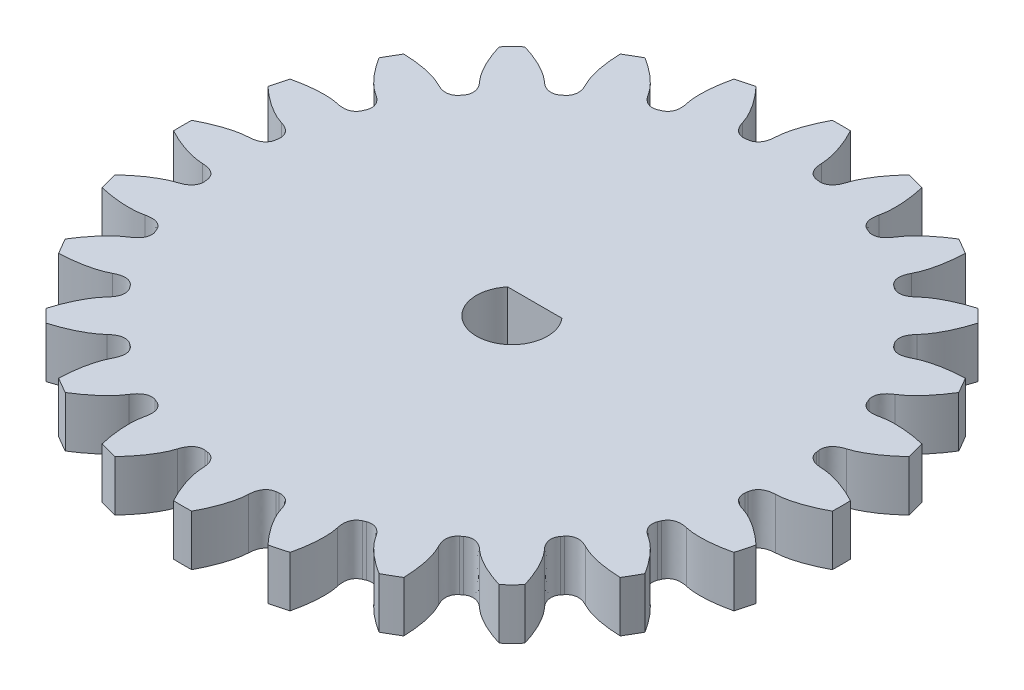
from build123d import *

# Parameters (mm, degrees)
EXTRUDE_1_DEPTH = 2


with BuildPart() as part:
    # Эскиз1 → Бобышка-Вытянуть1 (new body)
    with BuildSketch(Plane(origin=(0, 0, 0), x_dir=(1, 0, 0), z_dir=(0, 1, 0))):
        with BuildLine():
            ThreePointArc((0.357730054, 12.995077114), (0, 13), (-0.357730054, 12.995077114))
            add(Edge.make_bspline(
                [(-0.905776829, 11.30170004), (-0.903153797, 11.364174343), (-0.897985909, 11.426330365), (-0.890273167, 11.488168106), (-0.882433861, 11.551020594), (-0.871236283, 11.61359405), (-0.858868063, 11.675739131), (-0.846302347, 11.73887655), (-0.831417931, 11.801647657), (-0.815287884, 11.863979043), (-0.798904868, 11.927287976), (-0.780635548, 11.990183506), (-0.761176822, 12.052620709), (-0.741417879, 12.116021219), (-0.720022631, 12.178974672), (-0.697502256, 12.241450826), (-0.67463984, 12.304875873), (-0.650308122, 12.367826515), (-0.624909495, 12.430281414), (-0.599130965, 12.493670489), (-0.572004587, 12.556561325), (-0.543862193, 12.618938569), (-0.515305116, 12.682234954), (-0.485493692, 12.745011445), (-0.45471074, 12.807257013), (-0.423480821, 12.870406383), (-0.391153926, 12.933013083), (-0.357730054, 12.995077114)],
                knots=[0, 0, 0, 0, 1, 1, 1, 2, 2, 2, 3, 3, 3, 4, 4, 4, 5, 5, 5, 6, 6, 6, 7, 7, 7, 8, 8, 8, 9, 9, 9, 9], degree=3))
            add(Edge.make_bspline(
                [(-0.905776829, 11.30170004), (-0.905771657, 11.23039326), (-0.913828063, 11.160800255), (-0.929946047, 11.092921025), (-0.939606651, 11.052236386), (-0.951337627, 11.011263415), (-0.96761603, 10.972714088), (-0.979860318, 10.943718059), (-0.994015249, 10.915028809), (-1.010665897, 10.888305341), (-1.024787349, 10.865641106), (-1.040586182, 10.843617085), (-1.057994763, 10.823361181), (-1.073764387, 10.8050123), (-1.090989796, 10.787535026), (-1.10932187, 10.771741608), (-1.126572142, 10.756880182), (-1.145069758, 10.743071473), (-1.164321541, 10.730911074), (-1.182867326, 10.719196619), (-1.202457761, 10.708685073), (-1.222516171, 10.6998039), (-1.242144834, 10.691113003), (-1.262615206, 10.683752451), (-1.283298802, 10.67800565), (-1.303777222, 10.672315856), (-1.324670017, 10.668115352), (-1.345977185, 10.665404138)],
                knots=[0, 0, 0, 0, 1, 1, 1, 2, 2, 2, 3, 3, 3, 4, 4, 4, 5, 5, 5, 6, 6, 6, 7, 7, 7, 8, 8, 8, 9, 9, 9, 9], degree=3))
            ThreePointArc((-1.345977185, 10.665404138), (-1.403156566, 10.65803226), (-1.46029559, 10.650353834))
            add(Edge.make_bspline(
                [(-2.05018198, 11.151036243), (-2.031731423, 11.082157845), (-2.005937537, 11.017021315), (-1.972800323, 10.955626655), (-1.952938937, 10.91882866), (-1.931003099, 10.882288009), (-1.905302069, 10.849265379), (-1.88597027, 10.824426421), (-1.864872333, 10.800378299), (-1.8418725, 10.778874916), (-1.822366288, 10.760637847), (-1.801405552, 10.743453315), (-1.77934754, 10.728393287), (-1.759366213, 10.714751107), (-1.738204295, 10.702327621), (-1.716409234, 10.69181704), (-1.69590033, 10.681926704), (-1.674459048, 10.673376051), (-1.652715911, 10.666612735), (-1.631770134, 10.660097443), (-1.610126638, 10.655014447), (-1.588453086, 10.651627391), (-1.567243883, 10.648312902), (-1.545565971, 10.646501276), (-1.52409977, 10.646303601), (-1.502846508, 10.646107887), (-1.481578448, 10.647457965), (-1.46029559, 10.650353834)],
                knots=[0, 0, 0, 0, 1, 1, 1, 2, 2, 2, 3, 3, 3, 4, 4, 4, 5, 5, 5, 6, 6, 6, 7, 7, 7, 8, 8, 8, 9, 9, 9, 9], degree=3))
            add(Edge.make_bspline(
                [(-2.05018198, 11.151036243), (-2.068885174, 11.210702895), (-2.089964133, 11.269403455), (-2.113418854, 11.327137921), (-2.137258464, 11.385819801), (-2.164269696, 11.443362972), (-2.192300809, 11.50018938), (-2.220779525, 11.557923196), (-2.251403125, 11.614703059), (-2.283116104, 11.670735792), (-2.31532644, 11.727647289), (-2.349251809, 11.783671257), (-2.384207432, 11.838944675), (-2.419702365, 11.895070875), (-2.45666214, 11.950341743), (-2.494585171, 12.004860372), (-2.533084179, 12.060207035), (-2.572879639, 12.114715173), (-2.613577346, 12.168468325), (-2.654883793, 12.223025495), (-2.697363208, 12.276752555), (-2.740691092, 12.329720558), (-2.784657421, 12.383469055), (-2.829700796, 12.436390725), (-2.875545183, 12.488548112), (-2.922055228, 12.541462822), (-2.969484417, 12.593569434), (-3.017832751, 12.64486795)],
                knots=[0, 0, 0, 0, 1, 1, 1, 2, 2, 2, 3, 3, 3, 4, 4, 4, 5, 5, 5, 6, 6, 6, 7, 7, 7, 8, 8, 8, 9, 9, 9, 9], degree=3))
            ThreePointArc((-3.017832751, 12.64486795), (-3.364647586, 12.557035742), (-3.708914148, 12.459693248))
            add(Edge.make_bspline(
                [(-3.800008445, 10.682171655), (-3.813644329, 10.743196089), (-3.824739696, 10.804571744), (-3.833294544, 10.866298619), (-3.841989776, 10.929038422), (-3.847368949, 10.992377886), (-3.851506497, 11.055606556), (-3.855710113, 11.119844866), (-3.857579229, 11.184329469), (-3.85813135, 11.248711729), (-3.85869213, 11.314103698), (-3.857323882, 11.379584563), (-3.854688134, 11.444930559), (-3.85201172, 11.51128474), (-3.847639049, 11.577630603), (-3.842056056, 11.643806636), (-3.836388268, 11.710987756), (-3.829178458, 11.778090919), (-3.820809786, 11.844991368), (-3.812315939, 11.912892486), (-3.802391216, 11.980661192), (-3.791352169, 12.048196771), (-3.78015046, 12.116727499), (-3.767602588, 12.185080697), (-3.753978878, 12.253172513), (-3.740157352, 12.322253018), (-3.725135776, 12.391093263), (-3.708914148, 12.459693248)],
                knots=[0, 0, 0, 0, 1, 1, 1, 2, 2, 2, 3, 3, 3, 4, 4, 4, 5, 5, 5, 6, 6, 6, 7, 7, 7, 8, 8, 8, 9, 9, 9, 9], degree=3))
            add(Edge.make_bspline(
                [(-3.800008445, 10.682171655), (-3.781547896, 10.613295934), (-3.771317792, 10.543989102), (-3.769318131, 10.474251159), (-3.768119598, 10.432452467), (-3.768846266, 10.389839417), (-3.774592696, 10.348390465), (-3.778915046, 10.317213397), (-3.785162334, 10.285838144), (-3.794329082, 10.255715751), (-3.802103423, 10.23016888), (-3.811663687, 10.204806271), (-3.823236471, 10.180734898), (-3.833719719, 10.158929761), (-3.845834734, 10.137589747), (-3.859454521, 10.117589786), (-3.872270584, 10.098770052), (-3.886563952, 10.080644328), (-3.902012404, 10.063915557), (-3.916894333, 10.047800259), (-3.933096651, 10.032576508), (-3.95017297, 10.018806455), (-3.966883434, 10.005331422), (-3.984751244, 9.992923552), (-4.003242682, 9.98201926), (-4.02155069, 9.971223136), (-4.040644409, 9.961758307), (-4.060523839, 9.953624775)],
                knots=[0, 0, 0, 0, 1, 1, 1, 2, 2, 2, 3, 3, 3, 4, 4, 4, 5, 5, 5, 6, 6, 6, 7, 7, 7, 8, 8, 8, 9, 9, 9, 9], degree=3))
            ThreePointArc((-4.060523839, 9.953624775), (-4.113846898, 9.931704974), (-4.167051634, 9.909499517))
            add(Edge.make_bspline(
                [(-4.866424275, 10.240447755), (-4.830775365, 10.178691686), (-4.78900181, 10.122450579), (-4.741103611, 10.071724433), (-4.712394964, 10.041320804), (-4.681749155, 10.011702659), (-4.648376981, 9.986457164), (-4.623275101, 9.96746801), (-4.596671947, 9.949699856), (-4.568890329, 9.934881978), (-4.545328675, 9.922314901), (-4.520634474, 9.911140955), (-4.495430249, 9.902303119), (-4.472598913, 9.894297334), (-4.448942635, 9.887774275), (-4.425169884, 9.883262811), (-4.402799996, 9.879017574), (-4.379876237, 9.876307689), (-4.357123505, 9.875402366), (-4.335205155, 9.874530243), (-4.312983568, 9.875222195), (-4.29117189, 9.877560078), (-4.26982752, 9.879847873), (-4.248419382, 9.883708634), (-4.227633462, 9.889073556), (-4.207053733, 9.89438526), (-4.18685979, 9.901193914), (-4.167051634, 9.909499517)],
                knots=[0, 0, 0, 0, 1, 1, 1, 2, 2, 2, 3, 3, 3, 4, 4, 4, 5, 5, 5, 6, 6, 6, 7, 7, 7, 8, 8, 8, 9, 9, 9, 9], degree=3))
            add(Edge.make_bspline(
                [(-4.866424275, 10.240447755), (-4.89993304, 10.293240572), (-4.935486573, 10.344485323), (-4.973084874, 10.394182006), (-5.011300156, 10.444694204), (-5.052284271, 10.493285618), (-5.094068004, 10.540920727), (-5.136518943, 10.589316478), (-5.180794779, 10.636235643), (-5.225929503, 10.682151183), (-5.271772077, 10.72878682), (-5.319041538, 10.774121286), (-5.36711189, 10.818464127), (-5.415923891, 10.863491108), (-5.465929446, 10.907312773), (-5.51667074, 10.950158522), (-5.568182697, 10.993655017), (-5.620729904, 11.036006012), (-5.67395321, 11.077394228), (-5.727972608, 11.119401513), (-5.782910159, 11.160303386), (-5.838470809, 11.200252466), (-5.894850156, 11.240790204), (-5.952055852, 11.280250529), (-6.009837454, 11.318765296), (-6.068458042, 11.357839295), (-6.127757305, 11.39589484), (-6.187735242, 11.432931932)],
                knots=[0, 0, 0, 0, 1, 1, 1, 2, 2, 2, 3, 3, 3, 4, 4, 4, 5, 5, 5, 6, 6, 6, 7, 7, 7, 8, 8, 8, 9, 9, 9, 9], degree=3))
            ThreePointArc((-6.187735242, 11.432931932), (-6.5, 11.258330249), (-6.807341872, 11.075201878))
            add(Edge.make_bspline(
                [(-6.435275764, 9.334670926), (-6.464241303, 9.390086775), (-6.490843792, 9.446499413), (-6.515083232, 9.503908839), (-6.539720437, 9.562260343), (-6.561309779, 9.622049335), (-6.581671127, 9.682052664), (-6.602357607, 9.743014131), (-6.620852878, 9.804817712), (-6.63804954, 9.866863299), (-6.655515899, 9.929881951), (-6.671141968, 9.993485738), (-6.685508819, 10.057287305), (-6.700097328, 10.122073229), (-6.713045225, 10.187290142), (-6.724780086, 10.252656266), (-6.736693176, 10.319015177), (-6.747096611, 10.385697891), (-6.756328205, 10.452484734), (-6.765697881, 10.520270548), (-6.773651166, 10.588298798), (-6.78046776, 10.656390273), (-6.787384798, 10.725485089), (-6.792955594, 10.794756837), (-6.797419559, 10.864054556), (-6.801948341, 10.934358474), (-6.805255778, 11.004740914), (-6.807341872, 11.075201878)],
                knots=[0, 0, 0, 0, 1, 1, 1, 2, 2, 2, 3, 3, 3, 4, 4, 4, 5, 5, 5, 6, 6, 6, 7, 7, 7, 8, 8, 8, 9, 9, 9, 9], degree=3))
            add(Edge.make_bspline(
                [(-6.435275764, 9.334670926), (-6.399617895, 9.272920029), (-6.371798445, 9.208622516), (-6.351817413, 9.141778386), (-6.339841422, 9.101714154), (-6.32951426, 9.060365032), (-6.324337108, 9.018841134), (-6.320442957, 8.987607692), (-6.318356862, 8.955684607), (-6.319415012, 8.924216081), (-6.320312431, 8.897527551), (-6.322982611, 8.870554774), (-6.327930932, 8.844308356), (-6.332413387, 8.820532946), (-6.338592391, 8.796784479), (-6.346571724, 8.773940941), (-6.354080185, 8.752445432), (-6.363195236, 8.731237931), (-6.373787569, 8.711080826), (-6.383991463, 8.691662917), (-6.395701505, 8.672764433), (-6.40863201, 8.655043907), (-6.421285484, 8.637703038), (-6.435333069, 8.621093427), (-6.450372188, 8.605774754), (-6.465262123, 8.590608037), (-6.481255562, 8.576523897), (-6.498352504, 8.563522332)],
                knots=[0, 0, 0, 0, 1, 1, 1, 2, 2, 2, 3, 3, 3, 4, 4, 4, 5, 5, 5, 6, 6, 6, 7, 7, 7, 8, 8, 8, 9, 9, 9, 9], degree=3))
            ThreePointArc((-6.498352504, 8.563522332), (-6.544185362, 8.528548408), (-6.589829995, 8.493329185))
            add(Edge.make_bspline(
                [(-7.351027799, 8.631989675), (-7.300609948, 8.581564511), (-7.245703523, 8.538051564), (-7.186308524, 8.501450836), (-7.150709061, 8.47951353), (-7.113441743, 8.458836318), (-7.074672683, 8.443088397), (-7.045511375, 8.431243127), (-7.015215964, 8.420965811), (-6.984545833, 8.413843251), (-6.958534424, 8.407802592), (-6.931789628, 8.403400719), (-6.905156815, 8.401387358), (-6.881031389, 8.399563548), (-6.856492887, 8.399385452), (-6.83236252, 8.401180553), (-6.80965612, 8.402869722), (-6.786812099, 8.40618528), (-6.764600332, 8.411199646), (-6.74320311, 8.416030126), (-6.721917795, 8.42244987), (-6.701454421, 8.430353369), (-6.681429467, 8.438087539), (-6.661750033, 8.447357581), (-6.64306092, 8.45791949), (-6.624557198, 8.468376628), (-6.606813556, 8.480179859), (-6.589829995, 8.493329185)],
                knots=[0, 0, 0, 0, 1, 1, 1, 2, 2, 2, 3, 3, 3, 4, 4, 4, 5, 5, 5, 6, 6, 6, 7, 7, 7, 8, 8, 8, 9, 9, 9, 9], degree=3))
            add(Edge.make_bspline(
                [(-7.351027799, 8.631989675), (-7.397058566, 8.674310914), (-7.444663759, 8.714607611), (-7.493843377, 8.752879765), (-7.543830025, 8.791779958), (-7.595994023, 8.828108191), (-7.648682883, 8.863305747), (-7.702213083, 8.89906534), (-7.75712383, 8.932926344), (-7.812604442, 8.965595625), (-7.868955159, 8.998777259), (-7.926347375, 9.030332754), (-7.984256542, 9.060723127), (-8.043059155, 9.091582375), (-8.102702693, 9.120968463), (-8.162804316, 9.149221466), (-8.223818766, 9.177903577), (-8.285536715, 9.20521128), (-8.347658539, 9.231414022), (-8.410709557, 9.258008693), (-8.474361339, 9.283297984), (-8.538368389, 9.307505679), (-8.603318594, 9.332070078), (-8.668788137, 9.355379901), (-8.734569235, 9.37762733), (-8.801305469, 9.40019779), (-8.868433658, 9.421608846), (-8.935953802, 9.441860497)],
                knots=[0, 0, 0, 0, 1, 1, 1, 2, 2, 2, 3, 3, 3, 4, 4, 4, 5, 5, 5, 6, 6, 6, 7, 7, 7, 8, 8, 8, 9, 9, 9, 9], degree=3))
            ThreePointArc((-8.935953802, 9.441860497), (-9.192388155, 9.192388155), (-9.441860497, 8.935953802))
            add(Edge.make_bspline(
                [(-8.631989675, 7.351027799), (-8.674310914, 7.397058566), (-8.714607611, 7.444663759), (-8.752879765, 7.493843377), (-8.791779958, 7.543830025), (-8.828108191, 7.595994023), (-8.863305747, 7.648682883), (-8.89906534, 7.702213083), (-8.932926344, 7.75712383), (-8.965595625, 7.812604442), (-8.998777259, 7.868955159), (-9.030332754, 7.926347375), (-9.060723127, 7.984256542), (-9.091582375, 8.043059155), (-9.120968463, 8.102702693), (-9.149221466, 8.162804316), (-9.177903577, 8.223818766), (-9.20521128, 8.285536715), (-9.231414022, 8.347658539), (-9.258008693, 8.410709557), (-9.283297984, 8.474361339), (-9.307505679, 8.538368389), (-9.332070078, 8.603318594), (-9.355379901, 8.668788137), (-9.37762733, 8.734569235), (-9.40019779, 8.801305469), (-9.421608846, 8.868433658), (-9.441860497, 8.935953802)],
                knots=[0, 0, 0, 0, 1, 1, 1, 2, 2, 2, 3, 3, 3, 4, 4, 4, 5, 5, 5, 6, 6, 6, 7, 7, 7, 8, 8, 8, 9, 9, 9, 9], degree=3))
            add(Edge.make_bspline(
                [(-8.631989675, 7.351027799), (-8.581564511, 7.300609948), (-8.538051564, 7.245703523), (-8.501450836, 7.186308524), (-8.47951353, 7.150709061), (-8.458836318, 7.113441743), (-8.443088397, 7.074672683), (-8.431243127, 7.045511375), (-8.420965811, 7.015215964), (-8.413843251, 6.984545833), (-8.407802592, 6.958534424), (-8.403400719, 6.931789628), (-8.401387358, 6.905156815), (-8.399563548, 6.881031389), (-8.399385452, 6.856492887), (-8.401180553, 6.83236252), (-8.402869722, 6.80965612), (-8.40618528, 6.786812099), (-8.411199646, 6.764600332), (-8.416030126, 6.74320311), (-8.42244987, 6.721917795), (-8.430353369, 6.701454421), (-8.438087539, 6.681429467), (-8.447357581, 6.661750033), (-8.45791949, 6.64306092), (-8.468376628, 6.624557198), (-8.480179859, 6.606813556), (-8.493329185, 6.589829995)],
                knots=[0, 0, 0, 0, 1, 1, 1, 2, 2, 2, 3, 3, 3, 4, 4, 4, 5, 5, 5, 6, 6, 6, 7, 7, 7, 8, 8, 8, 9, 9, 9, 9], degree=3))
            ThreePointArc((-8.493329185, 6.589829995), (-8.528548408, 6.544185362), (-8.563522332, 6.498352504))
            add(Edge.make_bspline(
                [(-9.334670926, 6.435275764), (-9.272920029, 6.399617895), (-9.208622516, 6.371798445), (-9.141778386, 6.351817413), (-9.101714154, 6.339841422), (-9.060365032, 6.32951426), (-9.018841134, 6.324337108), (-8.987607692, 6.320442957), (-8.955684607, 6.318356862), (-8.924216081, 6.319415012), (-8.897527551, 6.320312431), (-8.870554774, 6.322982611), (-8.844308356, 6.327930932), (-8.820532946, 6.332413387), (-8.796784479, 6.338592391), (-8.773940941, 6.346571724), (-8.752445432, 6.354080185), (-8.731237931, 6.363195236), (-8.711080826, 6.373787569), (-8.691662917, 6.383991463), (-8.672764433, 6.395701505), (-8.655043907, 6.40863201), (-8.637703038, 6.421285484), (-8.621093427, 6.435333069), (-8.605774754, 6.450372188), (-8.590608037, 6.465262123), (-8.576523897, 6.481255562), (-8.563522332, 6.498352504)],
                knots=[0, 0, 0, 0, 1, 1, 1, 2, 2, 2, 3, 3, 3, 4, 4, 4, 5, 5, 5, 6, 6, 6, 7, 7, 7, 8, 8, 8, 9, 9, 9, 9], degree=3))
            add(Edge.make_bspline(
                [(-9.334670926, 6.435275764), (-9.390086775, 6.464241303), (-9.446499413, 6.490843792), (-9.503908839, 6.515083232), (-9.562260343, 6.539720437), (-9.622049335, 6.561309779), (-9.682052664, 6.581671127), (-9.743014131, 6.602357607), (-9.804817712, 6.620852878), (-9.866863299, 6.63804954), (-9.929881951, 6.655515899), (-9.993485738, 6.671141968), (-10.057287305, 6.685508819), (-10.122073229, 6.700097328), (-10.187290142, 6.713045225), (-10.252656266, 6.724780086), (-10.319015177, 6.736693176), (-10.385697891, 6.747096611), (-10.452484734, 6.756328205), (-10.520270548, 6.765697881), (-10.588298798, 6.773651166), (-10.656390273, 6.78046776), (-10.725485089, 6.787384798), (-10.794756837, 6.792955594), (-10.864054556, 6.797419559), (-10.934358474, 6.801948341), (-11.004740914, 6.805255778), (-11.075201878, 6.807341872)],
                knots=[0, 0, 0, 0, 1, 1, 1, 2, 2, 2, 3, 3, 3, 4, 4, 4, 5, 5, 5, 6, 6, 6, 7, 7, 7, 8, 8, 8, 9, 9, 9, 9], degree=3))
            ThreePointArc((-11.075201878, 6.807341872), (-11.258330249, 6.5), (-11.432931932, 6.187735242))
            add(Edge.make_bspline(
                [(-10.240447755, 4.866424275), (-10.293240572, 4.89993304), (-10.344485323, 4.935486573), (-10.394182006, 4.973084874), (-10.444694204, 5.011300156), (-10.493285618, 5.052284271), (-10.540920727, 5.094068004), (-10.589316478, 5.136518943), (-10.636235643, 5.180794779), (-10.682151183, 5.225929503), (-10.72878682, 5.271772077), (-10.774121286, 5.319041538), (-10.818464127, 5.36711189), (-10.863491108, 5.415923891), (-10.907312773, 5.465929446), (-10.950158522, 5.51667074), (-10.993655017, 5.568182697), (-11.036006012, 5.620729904), (-11.077394228, 5.67395321), (-11.119401513, 5.727972608), (-11.160303386, 5.782910159), (-11.200252466, 5.838470809), (-11.240790204, 5.894850156), (-11.280250529, 5.952055852), (-11.318765296, 6.009837454), (-11.357839295, 6.068458042), (-11.39589484, 6.127757305), (-11.432931932, 6.187735242)],
                knots=[0, 0, 0, 0, 1, 1, 1, 2, 2, 2, 3, 3, 3, 4, 4, 4, 5, 5, 5, 6, 6, 6, 7, 7, 7, 8, 8, 8, 9, 9, 9, 9], degree=3))
            add(Edge.make_bspline(
                [(-10.240447755, 4.866424275), (-10.178691686, 4.830775365), (-10.122450579, 4.78900181), (-10.071724433, 4.741103611), (-10.041320804, 4.712394964), (-10.011702659, 4.681749155), (-9.986457164, 4.648376981), (-9.96746801, 4.623275101), (-9.949699856, 4.596671947), (-9.934881978, 4.568890329), (-9.922314901, 4.545328675), (-9.911140955, 4.520634474), (-9.902303119, 4.495430249), (-9.894297334, 4.472598913), (-9.887774275, 4.448942635), (-9.883262811, 4.425169884), (-9.879017574, 4.402799996), (-9.876307689, 4.379876237), (-9.875402366, 4.357123505), (-9.874530243, 4.335205155), (-9.875222195, 4.312983568), (-9.877560078, 4.29117189), (-9.879847873, 4.26982752), (-9.883708634, 4.248419382), (-9.889073556, 4.227633462), (-9.89438526, 4.207053733), (-9.901193914, 4.18685979), (-9.909499517, 4.167051634)],
                knots=[0, 0, 0, 0, 1, 1, 1, 2, 2, 2, 3, 3, 3, 4, 4, 4, 5, 5, 5, 6, 6, 6, 7, 7, 7, 8, 8, 8, 9, 9, 9, 9], degree=3))
            ThreePointArc((-9.909499517, 4.167051634), (-9.931704974, 4.113846898), (-9.953624775, 4.060523839))
            add(Edge.make_bspline(
                [(-10.682171655, 3.800008445), (-10.613295934, 3.781547896), (-10.543989102, 3.771317792), (-10.474251159, 3.769318131), (-10.432452467, 3.768119598), (-10.389839417, 3.768846266), (-10.348390465, 3.774592696), (-10.317213397, 3.778915046), (-10.285838144, 3.785162334), (-10.255715751, 3.794329082), (-10.23016888, 3.802103423), (-10.204806271, 3.811663687), (-10.180734898, 3.823236471), (-10.158929761, 3.833719719), (-10.137589747, 3.845834734), (-10.117589786, 3.859454521), (-10.098770052, 3.872270584), (-10.080644328, 3.886563952), (-10.063915557, 3.902012404), (-10.047800259, 3.916894333), (-10.032576508, 3.933096651), (-10.018806455, 3.95017297), (-10.005331422, 3.966883434), (-9.992923552, 3.984751244), (-9.98201926, 4.003242682), (-9.971223136, 4.02155069), (-9.961758307, 4.040644409), (-9.953624775, 4.060523839)],
                knots=[0, 0, 0, 0, 1, 1, 1, 2, 2, 2, 3, 3, 3, 4, 4, 4, 5, 5, 5, 6, 6, 6, 7, 7, 7, 8, 8, 8, 9, 9, 9, 9], degree=3))
            add(Edge.make_bspline(
                [(-10.682171655, 3.800008445), (-10.743196089, 3.813644329), (-10.804571744, 3.824739696), (-10.866298619, 3.833294544), (-10.929038422, 3.841989776), (-10.992377886, 3.847368949), (-11.055606556, 3.851506497), (-11.119844866, 3.855710113), (-11.184329469, 3.857579229), (-11.248711729, 3.85813135), (-11.314103698, 3.85869213), (-11.379584563, 3.857323882), (-11.444930559, 3.854688134), (-11.51128474, 3.85201172), (-11.577630603, 3.847639049), (-11.643806636, 3.842056056), (-11.710987756, 3.836388268), (-11.778090919, 3.829178458), (-11.844991368, 3.820809786), (-11.912892486, 3.812315939), (-11.980661192, 3.802391216), (-12.048196771, 3.791352169), (-12.116727499, 3.78015046), (-12.185080697, 3.767602588), (-12.253172513, 3.753978878), (-12.322253018, 3.740157352), (-12.391093263, 3.725135776), (-12.459693248, 3.708914148)],
                knots=[0, 0, 0, 0, 1, 1, 1, 2, 2, 2, 3, 3, 3, 4, 4, 4, 5, 5, 5, 6, 6, 6, 7, 7, 7, 8, 8, 8, 9, 9, 9, 9], degree=3))
            ThreePointArc((-12.459693248, 3.708914148), (-12.557035742, 3.364647586), (-12.64486795, 3.017832751))
            add(Edge.make_bspline(
                [(-11.151036243, 2.05018198), (-11.210702895, 2.068885174), (-11.269403455, 2.089964133), (-11.327137921, 2.113418854), (-11.385819801, 2.137258464), (-11.443362972, 2.164269696), (-11.50018938, 2.192300809), (-11.557923196, 2.220779525), (-11.614703059, 2.251403125), (-11.670735792, 2.283116104), (-11.727647289, 2.31532644), (-11.783671257, 2.349251809), (-11.838944675, 2.384207432), (-11.895070875, 2.419702365), (-11.950341743, 2.45666214), (-12.004860372, 2.494585171), (-12.060207035, 2.533084179), (-12.114715173, 2.572879639), (-12.168468325, 2.613577346), (-12.223025495, 2.654883793), (-12.276752555, 2.697363208), (-12.329720558, 2.740691092), (-12.383469055, 2.784657421), (-12.436390725, 2.829700796), (-12.488548112, 2.875545183), (-12.541462822, 2.922055228), (-12.593569434, 2.969484417), (-12.64486795, 3.017832751)],
                knots=[0, 0, 0, 0, 1, 1, 1, 2, 2, 2, 3, 3, 3, 4, 4, 4, 5, 5, 5, 6, 6, 6, 7, 7, 7, 8, 8, 8, 9, 9, 9, 9], degree=3))
            add(Edge.make_bspline(
                [(-11.151036243, 2.05018198), (-11.082157845, 2.031731423), (-11.017021315, 2.005937537), (-10.955626655, 1.972800323), (-10.91882866, 1.952938937), (-10.882288009, 1.931003099), (-10.849265379, 1.905302069), (-10.824426421, 1.88597027), (-10.800378299, 1.864872333), (-10.778874916, 1.8418725), (-10.760637847, 1.822366288), (-10.743453315, 1.801405552), (-10.728393287, 1.77934754), (-10.714751107, 1.759366213), (-10.702327621, 1.738204295), (-10.69181704, 1.716409234), (-10.681926704, 1.69590033), (-10.673376051, 1.674459048), (-10.666612735, 1.652715911), (-10.660097443, 1.631770134), (-10.655014447, 1.610126638), (-10.651627391, 1.588453086), (-10.648312902, 1.567243883), (-10.646501276, 1.545565971), (-10.646303601, 1.52409977), (-10.646107887, 1.502846508), (-10.647457965, 1.481578448), (-10.650353834, 1.46029559)],
                knots=[0, 0, 0, 0, 1, 1, 1, 2, 2, 2, 3, 3, 3, 4, 4, 4, 5, 5, 5, 6, 6, 6, 7, 7, 7, 8, 8, 8, 9, 9, 9, 9], degree=3))
            ThreePointArc((-10.650353834, 1.46029559), (-10.65803226, 1.403156566), (-10.665404138, 1.345977185))
            add(Edge.make_bspline(
                [(-11.30170004, 0.905776829), (-11.23039326, 0.905771657), (-11.160800255, 0.913828063), (-11.092921025, 0.929946047), (-11.052236386, 0.939606651), (-11.011263415, 0.951337627), (-10.972714088, 0.96761603), (-10.943718059, 0.979860318), (-10.915028809, 0.994015249), (-10.888305341, 1.010665897), (-10.865641106, 1.024787349), (-10.843617085, 1.040586182), (-10.823361181, 1.057994763), (-10.8050123, 1.073764387), (-10.787535026, 1.090989796), (-10.771741608, 1.10932187), (-10.756880182, 1.126572142), (-10.743071473, 1.145069758), (-10.730911074, 1.164321541), (-10.719196619, 1.182867326), (-10.708685073, 1.202457761), (-10.6998039, 1.222516171), (-10.691113003, 1.242144834), (-10.683752451, 1.262615206), (-10.67800565, 1.283298802), (-10.672315856, 1.303777222), (-10.668115352, 1.324670017), (-10.665404138, 1.345977185)],
                knots=[0, 0, 0, 0, 1, 1, 1, 2, 2, 2, 3, 3, 3, 4, 4, 4, 5, 5, 5, 6, 6, 6, 7, 7, 7, 8, 8, 8, 9, 9, 9, 9], degree=3))
            add(Edge.make_bspline(
                [(-11.30170004, 0.905776829), (-11.364174343, 0.903153797), (-11.426330365, 0.897985909), (-11.488168106, 0.890273167), (-11.551020594, 0.882433861), (-11.61359405, 0.871236283), (-11.675739131, 0.858868063), (-11.73887655, 0.846302347), (-11.801647657, 0.831417931), (-11.863979043, 0.815287884), (-11.927287976, 0.798904868), (-11.990183506, 0.780635548), (-12.052620709, 0.761176822), (-12.116021219, 0.741417879), (-12.178974672, 0.720022631), (-12.241450826, 0.697502256), (-12.304875873, 0.67463984), (-12.367826515, 0.650308122), (-12.430281414, 0.624909495), (-12.493670489, 0.599130965), (-12.556561325, 0.572004587), (-12.618938569, 0.543862193), (-12.682234954, 0.515305116), (-12.745011445, 0.485493692), (-12.807257013, 0.45471074), (-12.870406383, 0.423480821), (-12.933013083, 0.391153926), (-12.995077114, 0.357730054)],
                knots=[0, 0, 0, 0, 1, 1, 1, 2, 2, 2, 3, 3, 3, 4, 4, 4, 5, 5, 5, 6, 6, 6, 7, 7, 7, 8, 8, 8, 9, 9, 9, 9], degree=3))
            ThreePointArc((-12.995077114, 0.357730054), (-13, 0), (-12.995077114, -0.357730054))
            add(Edge.make_bspline(
                [(-11.30170004, -0.905776829), (-11.364174343, -0.903153797), (-11.426330365, -0.897985909), (-11.488168106, -0.890273167), (-11.551020594, -0.882433861), (-11.61359405, -0.871236283), (-11.675739131, -0.858868063), (-11.73887655, -0.846302347), (-11.801647657, -0.831417931), (-11.863979043, -0.815287884), (-11.927287976, -0.798904868), (-11.990183506, -0.780635548), (-12.052620709, -0.761176822), (-12.116021219, -0.741417879), (-12.178974672, -0.720022631), (-12.241450826, -0.697502256), (-12.304875873, -0.67463984), (-12.367826515, -0.650308122), (-12.430281414, -0.624909495), (-12.493670489, -0.599130965), (-12.556561325, -0.572004587), (-12.618938569, -0.543862193), (-12.682234954, -0.515305116), (-12.745011445, -0.485493692), (-12.807257013, -0.45471074), (-12.870406383, -0.423480821), (-12.933013083, -0.391153926), (-12.995077114, -0.357730054)],
                knots=[0, 0, 0, 0, 1, 1, 1, 2, 2, 2, 3, 3, 3, 4, 4, 4, 5, 5, 5, 6, 6, 6, 7, 7, 7, 8, 8, 8, 9, 9, 9, 9], degree=3))
            add(Edge.make_bspline(
                [(-11.30170004, -0.905776829), (-11.23039326, -0.905771657), (-11.160800255, -0.913828063), (-11.092921025, -0.929946047), (-11.052236386, -0.939606651), (-11.011263415, -0.951337627), (-10.972714088, -0.96761603), (-10.943718059, -0.979860318), (-10.915028809, -0.994015249), (-10.888305341, -1.010665897), (-10.865641106, -1.024787349), (-10.843617085, -1.040586182), (-10.823361181, -1.057994763), (-10.8050123, -1.073764387), (-10.787535026, -1.090989796), (-10.771741608, -1.10932187), (-10.756880182, -1.126572142), (-10.743071473, -1.145069758), (-10.730911074, -1.164321541), (-10.719196619, -1.182867326), (-10.708685073, -1.202457761), (-10.6998039, -1.222516171), (-10.691113003, -1.242144834), (-10.683752451, -1.262615206), (-10.67800565, -1.283298802), (-10.672315856, -1.303777222), (-10.668115352, -1.324670017), (-10.665404138, -1.345977185)],
                knots=[0, 0, 0, 0, 1, 1, 1, 2, 2, 2, 3, 3, 3, 4, 4, 4, 5, 5, 5, 6, 6, 6, 7, 7, 7, 8, 8, 8, 9, 9, 9, 9], degree=3))
            ThreePointArc((-10.665404138, -1.345977185), (-10.65803226, -1.403156566), (-10.650353834, -1.46029559))
            add(Edge.make_bspline(
                [(-11.151036243, -2.05018198), (-11.082157845, -2.031731423), (-11.017021315, -2.005937537), (-10.955626655, -1.972800323), (-10.91882866, -1.952938937), (-10.882288009, -1.931003099), (-10.849265379, -1.905302069), (-10.824426421, -1.88597027), (-10.800378299, -1.864872333), (-10.778874916, -1.8418725), (-10.760637847, -1.822366288), (-10.743453315, -1.801405552), (-10.728393287, -1.77934754), (-10.714751107, -1.759366213), (-10.702327621, -1.738204295), (-10.69181704, -1.716409234), (-10.681926704, -1.69590033), (-10.673376051, -1.674459048), (-10.666612735, -1.652715911), (-10.660097443, -1.631770134), (-10.655014447, -1.610126638), (-10.651627391, -1.588453086), (-10.648312902, -1.567243883), (-10.646501276, -1.545565971), (-10.646303601, -1.52409977), (-10.646107887, -1.502846508), (-10.647457965, -1.481578448), (-10.650353834, -1.46029559)],
                knots=[0, 0, 0, 0, 1, 1, 1, 2, 2, 2, 3, 3, 3, 4, 4, 4, 5, 5, 5, 6, 6, 6, 7, 7, 7, 8, 8, 8, 9, 9, 9, 9], degree=3))
            add(Edge.make_bspline(
                [(-11.151036243, -2.05018198), (-11.210702895, -2.068885174), (-11.269403455, -2.089964133), (-11.327137921, -2.113418854), (-11.385819801, -2.137258464), (-11.443362972, -2.164269696), (-11.50018938, -2.192300809), (-11.557923196, -2.220779525), (-11.614703059, -2.251403125), (-11.670735792, -2.283116104), (-11.727647289, -2.31532644), (-11.783671257, -2.349251809), (-11.838944675, -2.384207432), (-11.895070875, -2.419702365), (-11.950341743, -2.45666214), (-12.004860372, -2.494585171), (-12.060207035, -2.533084179), (-12.114715173, -2.572879639), (-12.168468325, -2.613577346), (-12.223025495, -2.654883793), (-12.276752555, -2.697363208), (-12.329720558, -2.740691092), (-12.383469055, -2.784657421), (-12.436390725, -2.829700796), (-12.488548112, -2.875545183), (-12.541462822, -2.922055228), (-12.593569434, -2.969484417), (-12.64486795, -3.017832751)],
                knots=[0, 0, 0, 0, 1, 1, 1, 2, 2, 2, 3, 3, 3, 4, 4, 4, 5, 5, 5, 6, 6, 6, 7, 7, 7, 8, 8, 8, 9, 9, 9, 9], degree=3))
            ThreePointArc((-12.64486795, -3.017832751), (-12.557035742, -3.364647586), (-12.459693248, -3.708914148))
            add(Edge.make_bspline(
                [(-10.682171655, -3.800008445), (-10.743196089, -3.813644329), (-10.804571744, -3.824739696), (-10.866298619, -3.833294544), (-10.929038422, -3.841989776), (-10.992377886, -3.847368949), (-11.055606556, -3.851506497), (-11.119844866, -3.855710113), (-11.184329469, -3.857579229), (-11.248711729, -3.85813135), (-11.314103698, -3.85869213), (-11.379584563, -3.857323882), (-11.444930559, -3.854688134), (-11.51128474, -3.85201172), (-11.577630603, -3.847639049), (-11.643806636, -3.842056056), (-11.710987756, -3.836388268), (-11.778090919, -3.829178458), (-11.844991368, -3.820809786), (-11.912892486, -3.812315939), (-11.980661192, -3.802391216), (-12.048196771, -3.791352169), (-12.116727499, -3.78015046), (-12.185080697, -3.767602588), (-12.253172513, -3.753978878), (-12.322253018, -3.740157352), (-12.391093263, -3.725135776), (-12.459693248, -3.708914148)],
                knots=[0, 0, 0, 0, 1, 1, 1, 2, 2, 2, 3, 3, 3, 4, 4, 4, 5, 5, 5, 6, 6, 6, 7, 7, 7, 8, 8, 8, 9, 9, 9, 9], degree=3))
            add(Edge.make_bspline(
                [(-10.682171655, -3.800008445), (-10.613295934, -3.781547896), (-10.543989102, -3.771317792), (-10.474251159, -3.769318131), (-10.432452467, -3.768119598), (-10.389839417, -3.768846266), (-10.348390465, -3.774592696), (-10.317213397, -3.778915046), (-10.285838144, -3.785162334), (-10.255715751, -3.794329082), (-10.23016888, -3.802103423), (-10.204806271, -3.811663687), (-10.180734898, -3.823236471), (-10.158929761, -3.833719719), (-10.137589747, -3.845834734), (-10.117589786, -3.859454521), (-10.098770052, -3.872270584), (-10.080644328, -3.886563952), (-10.063915557, -3.902012404), (-10.047800259, -3.916894333), (-10.032576508, -3.933096651), (-10.018806455, -3.95017297), (-10.005331422, -3.966883434), (-9.992923552, -3.984751244), (-9.98201926, -4.003242682), (-9.971223136, -4.02155069), (-9.961758307, -4.040644409), (-9.953624775, -4.060523839)],
                knots=[0, 0, 0, 0, 1, 1, 1, 2, 2, 2, 3, 3, 3, 4, 4, 4, 5, 5, 5, 6, 6, 6, 7, 7, 7, 8, 8, 8, 9, 9, 9, 9], degree=3))
            ThreePointArc((-9.953624775, -4.060523839), (-9.931704974, -4.113846898), (-9.909499517, -4.167051634))
            add(Edge.make_bspline(
                [(-10.240447755, -4.866424275), (-10.178691686, -4.830775365), (-10.122450579, -4.78900181), (-10.071724433, -4.741103611), (-10.041320804, -4.712394964), (-10.011702659, -4.681749155), (-9.986457164, -4.648376981), (-9.96746801, -4.623275101), (-9.949699856, -4.596671947), (-9.934881978, -4.568890329), (-9.922314901, -4.545328675), (-9.911140955, -4.520634474), (-9.902303119, -4.495430249), (-9.894297334, -4.472598913), (-9.887774275, -4.448942635), (-9.883262811, -4.425169884), (-9.879017574, -4.402799996), (-9.876307689, -4.379876237), (-9.875402366, -4.357123505), (-9.874530243, -4.335205155), (-9.875222195, -4.312983568), (-9.877560078, -4.29117189), (-9.879847873, -4.26982752), (-9.883708634, -4.248419382), (-9.889073556, -4.227633462), (-9.89438526, -4.207053733), (-9.901193914, -4.18685979), (-9.909499517, -4.167051634)],
                knots=[0, 0, 0, 0, 1, 1, 1, 2, 2, 2, 3, 3, 3, 4, 4, 4, 5, 5, 5, 6, 6, 6, 7, 7, 7, 8, 8, 8, 9, 9, 9, 9], degree=3))
            add(Edge.make_bspline(
                [(-10.240447755, -4.866424275), (-10.293240572, -4.89993304), (-10.344485323, -4.935486573), (-10.394182006, -4.973084874), (-10.444694204, -5.011300156), (-10.493285618, -5.052284271), (-10.540920727, -5.094068004), (-10.589316478, -5.136518943), (-10.636235643, -5.180794779), (-10.682151183, -5.225929503), (-10.72878682, -5.271772077), (-10.774121286, -5.319041538), (-10.818464127, -5.36711189), (-10.863491108, -5.415923891), (-10.907312773, -5.465929446), (-10.950158522, -5.51667074), (-10.993655017, -5.568182697), (-11.036006012, -5.620729904), (-11.077394228, -5.67395321), (-11.119401513, -5.727972608), (-11.160303386, -5.782910159), (-11.200252466, -5.838470809), (-11.240790204, -5.894850156), (-11.280250529, -5.952055852), (-11.318765296, -6.009837454), (-11.357839295, -6.068458042), (-11.39589484, -6.127757305), (-11.432931932, -6.187735242)],
                knots=[0, 0, 0, 0, 1, 1, 1, 2, 2, 2, 3, 3, 3, 4, 4, 4, 5, 5, 5, 6, 6, 6, 7, 7, 7, 8, 8, 8, 9, 9, 9, 9], degree=3))
            ThreePointArc((-11.432931932, -6.187735242), (-11.258330249, -6.5), (-11.075201878, -6.807341872))
            add(Edge.make_bspline(
                [(-9.334670926, -6.435275764), (-9.390086775, -6.464241303), (-9.446499413, -6.490843792), (-9.503908839, -6.515083232), (-9.562260343, -6.539720437), (-9.622049335, -6.561309779), (-9.682052664, -6.581671127), (-9.743014131, -6.602357607), (-9.804817712, -6.620852878), (-9.866863299, -6.63804954), (-9.929881951, -6.655515899), (-9.993485738, -6.671141968), (-10.057287305, -6.685508819), (-10.122073229, -6.700097328), (-10.187290142, -6.713045225), (-10.252656266, -6.724780086), (-10.319015177, -6.736693176), (-10.385697891, -6.747096611), (-10.452484734, -6.756328205), (-10.520270548, -6.765697881), (-10.588298798, -6.773651166), (-10.656390273, -6.78046776), (-10.725485089, -6.787384798), (-10.794756837, -6.792955594), (-10.864054556, -6.797419559), (-10.934358474, -6.801948341), (-11.004740914, -6.805255778), (-11.075201878, -6.807341872)],
                knots=[0, 0, 0, 0, 1, 1, 1, 2, 2, 2, 3, 3, 3, 4, 4, 4, 5, 5, 5, 6, 6, 6, 7, 7, 7, 8, 8, 8, 9, 9, 9, 9], degree=3))
            add(Edge.make_bspline(
                [(-9.334670926, -6.435275764), (-9.272920029, -6.399617895), (-9.208622516, -6.371798445), (-9.141778386, -6.351817413), (-9.101714154, -6.339841422), (-9.060365032, -6.32951426), (-9.018841134, -6.324337108), (-8.987607692, -6.320442957), (-8.955684607, -6.318356862), (-8.924216081, -6.319415012), (-8.897527551, -6.320312431), (-8.870554774, -6.322982611), (-8.844308356, -6.327930932), (-8.820532946, -6.332413387), (-8.796784479, -6.338592391), (-8.773940941, -6.346571724), (-8.752445432, -6.354080185), (-8.731237931, -6.363195236), (-8.711080826, -6.373787569), (-8.691662917, -6.383991463), (-8.672764433, -6.395701505), (-8.655043907, -6.40863201), (-8.637703038, -6.421285484), (-8.621093427, -6.435333069), (-8.605774754, -6.450372188), (-8.590608037, -6.465262123), (-8.576523897, -6.481255562), (-8.563522332, -6.498352504)],
                knots=[0, 0, 0, 0, 1, 1, 1, 2, 2, 2, 3, 3, 3, 4, 4, 4, 5, 5, 5, 6, 6, 6, 7, 7, 7, 8, 8, 8, 9, 9, 9, 9], degree=3))
            ThreePointArc((-8.563522332, -6.498352504), (-8.528548408, -6.544185362), (-8.493329185, -6.589829995))
            add(Edge.make_bspline(
                [(-8.631989675, -7.351027799), (-8.581564511, -7.300609948), (-8.538051564, -7.245703523), (-8.501450836, -7.186308524), (-8.47951353, -7.150709061), (-8.458836318, -7.113441743), (-8.443088397, -7.074672683), (-8.431243127, -7.045511375), (-8.420965811, -7.015215964), (-8.413843251, -6.984545833), (-8.407802592, -6.958534424), (-8.403400719, -6.931789628), (-8.401387358, -6.905156815), (-8.399563548, -6.881031389), (-8.399385452, -6.856492887), (-8.401180553, -6.83236252), (-8.402869722, -6.80965612), (-8.40618528, -6.786812099), (-8.411199646, -6.764600332), (-8.416030126, -6.74320311), (-8.42244987, -6.721917795), (-8.430353369, -6.701454421), (-8.438087539, -6.681429467), (-8.447357581, -6.661750033), (-8.45791949, -6.64306092), (-8.468376628, -6.624557198), (-8.480179859, -6.606813556), (-8.493329185, -6.589829995)],
                knots=[0, 0, 0, 0, 1, 1, 1, 2, 2, 2, 3, 3, 3, 4, 4, 4, 5, 5, 5, 6, 6, 6, 7, 7, 7, 8, 8, 8, 9, 9, 9, 9], degree=3))
            add(Edge.make_bspline(
                [(-8.631989675, -7.351027799), (-8.674310914, -7.397058566), (-8.714607611, -7.444663759), (-8.752879765, -7.493843377), (-8.791779958, -7.543830025), (-8.828108191, -7.595994023), (-8.863305747, -7.648682883), (-8.89906534, -7.702213083), (-8.932926344, -7.75712383), (-8.965595625, -7.812604442), (-8.998777259, -7.868955159), (-9.030332754, -7.926347375), (-9.060723127, -7.984256542), (-9.091582375, -8.043059155), (-9.120968463, -8.102702693), (-9.149221466, -8.162804316), (-9.177903577, -8.223818766), (-9.20521128, -8.285536715), (-9.231414022, -8.347658539), (-9.258008693, -8.410709557), (-9.283297984, -8.474361339), (-9.307505679, -8.538368389), (-9.332070078, -8.603318594), (-9.355379901, -8.668788137), (-9.37762733, -8.734569235), (-9.40019779, -8.801305469), (-9.421608846, -8.868433658), (-9.441860497, -8.935953802)],
                knots=[0, 0, 0, 0, 1, 1, 1, 2, 2, 2, 3, 3, 3, 4, 4, 4, 5, 5, 5, 6, 6, 6, 7, 7, 7, 8, 8, 8, 9, 9, 9, 9], degree=3))
            ThreePointArc((-9.441860497, -8.935953802), (-9.192388155, -9.192388155), (-8.935953802, -9.441860497))
            add(Edge.make_bspline(
                [(-7.351027799, -8.631989675), (-7.397058566, -8.674310914), (-7.444663759, -8.714607611), (-7.493843377, -8.752879765), (-7.543830025, -8.791779958), (-7.595994023, -8.828108191), (-7.648682883, -8.863305747), (-7.702213083, -8.89906534), (-7.75712383, -8.932926344), (-7.812604442, -8.965595625), (-7.868955159, -8.998777259), (-7.926347375, -9.030332754), (-7.984256542, -9.060723127), (-8.043059155, -9.091582375), (-8.102702693, -9.120968463), (-8.162804316, -9.149221466), (-8.223818766, -9.177903577), (-8.285536715, -9.20521128), (-8.347658539, -9.231414022), (-8.410709557, -9.258008693), (-8.474361339, -9.283297984), (-8.538368389, -9.307505679), (-8.603318594, -9.332070078), (-8.668788137, -9.355379901), (-8.734569235, -9.37762733), (-8.801305469, -9.40019779), (-8.868433658, -9.421608846), (-8.935953802, -9.441860497)],
                knots=[0, 0, 0, 0, 1, 1, 1, 2, 2, 2, 3, 3, 3, 4, 4, 4, 5, 5, 5, 6, 6, 6, 7, 7, 7, 8, 8, 8, 9, 9, 9, 9], degree=3))
            add(Edge.make_bspline(
                [(-7.351027799, -8.631989675), (-7.300609948, -8.581564511), (-7.245703523, -8.538051564), (-7.186308524, -8.501450836), (-7.150709061, -8.47951353), (-7.113441743, -8.458836318), (-7.074672683, -8.443088397), (-7.045511375, -8.431243127), (-7.015215964, -8.420965811), (-6.984545833, -8.413843251), (-6.958534424, -8.407802592), (-6.931789628, -8.403400719), (-6.905156815, -8.401387358), (-6.881031389, -8.399563548), (-6.856492887, -8.399385452), (-6.83236252, -8.401180553), (-6.80965612, -8.402869722), (-6.786812099, -8.40618528), (-6.764600332, -8.411199646), (-6.74320311, -8.416030126), (-6.721917795, -8.42244987), (-6.701454421, -8.430353369), (-6.681429467, -8.438087539), (-6.661750033, -8.447357581), (-6.64306092, -8.45791949), (-6.624557198, -8.468376628), (-6.606813556, -8.480179859), (-6.589829995, -8.493329185)],
                knots=[0, 0, 0, 0, 1, 1, 1, 2, 2, 2, 3, 3, 3, 4, 4, 4, 5, 5, 5, 6, 6, 6, 7, 7, 7, 8, 8, 8, 9, 9, 9, 9], degree=3))
            ThreePointArc((-6.589829995, -8.493329185), (-6.544185362, -8.528548408), (-6.498352504, -8.563522332))
            add(Edge.make_bspline(
                [(-6.435275764, -9.334670926), (-6.399617895, -9.272920029), (-6.371798445, -9.208622516), (-6.351817413, -9.141778386), (-6.339841422, -9.101714154), (-6.32951426, -9.060365032), (-6.324337108, -9.018841134), (-6.320442957, -8.987607692), (-6.318356862, -8.955684607), (-6.319415012, -8.924216081), (-6.320312431, -8.897527551), (-6.322982611, -8.870554774), (-6.327930932, -8.844308356), (-6.332413387, -8.820532946), (-6.338592391, -8.796784479), (-6.346571724, -8.773940941), (-6.354080185, -8.752445432), (-6.363195236, -8.731237931), (-6.373787569, -8.711080826), (-6.383991463, -8.691662917), (-6.395701505, -8.672764433), (-6.40863201, -8.655043907), (-6.421285484, -8.637703038), (-6.435333069, -8.621093427), (-6.450372188, -8.605774754), (-6.465262123, -8.590608037), (-6.481255562, -8.576523897), (-6.498352504, -8.563522332)],
                knots=[0, 0, 0, 0, 1, 1, 1, 2, 2, 2, 3, 3, 3, 4, 4, 4, 5, 5, 5, 6, 6, 6, 7, 7, 7, 8, 8, 8, 9, 9, 9, 9], degree=3))
            add(Edge.make_bspline(
                [(-6.435275764, -9.334670926), (-6.464241303, -9.390086775), (-6.490843792, -9.446499413), (-6.515083232, -9.503908839), (-6.539720437, -9.562260343), (-6.561309779, -9.622049335), (-6.581671127, -9.682052664), (-6.602357607, -9.743014131), (-6.620852878, -9.804817712), (-6.63804954, -9.866863299), (-6.655515899, -9.929881951), (-6.671141968, -9.993485738), (-6.685508819, -10.057287305), (-6.700097328, -10.122073229), (-6.713045225, -10.187290142), (-6.724780086, -10.252656266), (-6.736693176, -10.319015177), (-6.747096611, -10.385697891), (-6.756328205, -10.452484734), (-6.765697881, -10.520270548), (-6.773651166, -10.588298798), (-6.78046776, -10.656390273), (-6.787384798, -10.725485089), (-6.792955594, -10.794756837), (-6.797419559, -10.864054556), (-6.801948341, -10.934358474), (-6.805255778, -11.004740914), (-6.807341872, -11.075201878)],
                knots=[0, 0, 0, 0, 1, 1, 1, 2, 2, 2, 3, 3, 3, 4, 4, 4, 5, 5, 5, 6, 6, 6, 7, 7, 7, 8, 8, 8, 9, 9, 9, 9], degree=3))
            ThreePointArc((-6.807341872, -11.075201878), (-6.5, -11.258330249), (-6.187735242, -11.432931932))
            add(Edge.make_bspline(
                [(-4.866424275, -10.240447755), (-4.89993304, -10.293240572), (-4.935486573, -10.344485323), (-4.973084874, -10.394182006), (-5.011300156, -10.444694204), (-5.052284271, -10.493285618), (-5.094068004, -10.540920727), (-5.136518943, -10.589316478), (-5.180794779, -10.636235643), (-5.225929503, -10.682151183), (-5.271772077, -10.72878682), (-5.319041538, -10.774121286), (-5.36711189, -10.818464127), (-5.415923891, -10.863491108), (-5.465929446, -10.907312773), (-5.51667074, -10.950158522), (-5.568182697, -10.993655017), (-5.620729904, -11.036006012), (-5.67395321, -11.077394228), (-5.727972608, -11.119401513), (-5.782910159, -11.160303386), (-5.838470809, -11.200252466), (-5.894850156, -11.240790204), (-5.952055852, -11.280250529), (-6.009837454, -11.318765296), (-6.068458042, -11.357839295), (-6.127757305, -11.39589484), (-6.187735242, -11.432931932)],
                knots=[0, 0, 0, 0, 1, 1, 1, 2, 2, 2, 3, 3, 3, 4, 4, 4, 5, 5, 5, 6, 6, 6, 7, 7, 7, 8, 8, 8, 9, 9, 9, 9], degree=3))
            add(Edge.make_bspline(
                [(-4.866424275, -10.240447755), (-4.830775365, -10.178691686), (-4.78900181, -10.122450579), (-4.741103611, -10.071724433), (-4.712394964, -10.041320804), (-4.681749155, -10.011702659), (-4.648376981, -9.986457164), (-4.623275101, -9.96746801), (-4.596671947, -9.949699856), (-4.568890329, -9.934881978), (-4.545328675, -9.922314901), (-4.520634474, -9.911140955), (-4.495430249, -9.902303119), (-4.472598913, -9.894297334), (-4.448942635, -9.887774275), (-4.425169884, -9.883262811), (-4.402799996, -9.879017574), (-4.379876237, -9.876307689), (-4.357123505, -9.875402366), (-4.335205155, -9.874530243), (-4.312983568, -9.875222195), (-4.29117189, -9.877560078), (-4.26982752, -9.879847873), (-4.248419382, -9.883708634), (-4.227633462, -9.889073556), (-4.207053733, -9.89438526), (-4.18685979, -9.901193914), (-4.167051634, -9.909499517)],
                knots=[0, 0, 0, 0, 1, 1, 1, 2, 2, 2, 3, 3, 3, 4, 4, 4, 5, 5, 5, 6, 6, 6, 7, 7, 7, 8, 8, 8, 9, 9, 9, 9], degree=3))
            ThreePointArc((-4.167051634, -9.909499517), (-4.113846898, -9.931704974), (-4.060523839, -9.953624775))
            add(Edge.make_bspline(
                [(-3.800008445, -10.682171655), (-3.781547896, -10.613295934), (-3.771317792, -10.543989102), (-3.769318131, -10.474251159), (-3.768119598, -10.432452467), (-3.768846266, -10.389839417), (-3.774592696, -10.348390465), (-3.778915046, -10.317213397), (-3.785162334, -10.285838144), (-3.794329082, -10.255715751), (-3.802103423, -10.23016888), (-3.811663687, -10.204806271), (-3.823236471, -10.180734898), (-3.833719719, -10.158929761), (-3.845834734, -10.137589747), (-3.859454521, -10.117589786), (-3.872270584, -10.098770052), (-3.886563952, -10.080644328), (-3.902012404, -10.063915557), (-3.916894333, -10.047800259), (-3.933096651, -10.032576508), (-3.95017297, -10.018806455), (-3.966883434, -10.005331422), (-3.984751244, -9.992923552), (-4.003242682, -9.98201926), (-4.02155069, -9.971223136), (-4.040644409, -9.961758307), (-4.060523839, -9.953624775)],
                knots=[0, 0, 0, 0, 1, 1, 1, 2, 2, 2, 3, 3, 3, 4, 4, 4, 5, 5, 5, 6, 6, 6, 7, 7, 7, 8, 8, 8, 9, 9, 9, 9], degree=3))
            add(Edge.make_bspline(
                [(-3.800008445, -10.682171655), (-3.813644329, -10.743196089), (-3.824739696, -10.804571744), (-3.833294544, -10.866298619), (-3.841989776, -10.929038422), (-3.847368949, -10.992377886), (-3.851506497, -11.055606556), (-3.855710113, -11.119844866), (-3.857579229, -11.184329469), (-3.85813135, -11.248711729), (-3.85869213, -11.314103698), (-3.857323882, -11.379584563), (-3.854688134, -11.444930559), (-3.85201172, -11.51128474), (-3.847639049, -11.577630603), (-3.842056056, -11.643806636), (-3.836388268, -11.710987756), (-3.829178458, -11.778090919), (-3.820809786, -11.844991368), (-3.812315939, -11.912892486), (-3.802391216, -11.980661192), (-3.791352169, -12.048196771), (-3.78015046, -12.116727499), (-3.767602588, -12.185080697), (-3.753978878, -12.253172513), (-3.740157352, -12.322253018), (-3.725135776, -12.391093263), (-3.708914148, -12.459693248)],
                knots=[0, 0, 0, 0, 1, 1, 1, 2, 2, 2, 3, 3, 3, 4, 4, 4, 5, 5, 5, 6, 6, 6, 7, 7, 7, 8, 8, 8, 9, 9, 9, 9], degree=3))
            ThreePointArc((-3.708914148, -12.459693248), (-3.364647586, -12.557035742), (-3.017832751, -12.64486795))
            add(Edge.make_bspline(
                [(-2.05018198, -11.151036243), (-2.068885174, -11.210702895), (-2.089964133, -11.269403455), (-2.113418854, -11.327137921), (-2.137258464, -11.385819801), (-2.164269696, -11.443362972), (-2.192300809, -11.50018938), (-2.220779525, -11.557923196), (-2.251403125, -11.614703059), (-2.283116104, -11.670735792), (-2.31532644, -11.727647289), (-2.349251809, -11.783671257), (-2.384207432, -11.838944675), (-2.419702365, -11.895070875), (-2.45666214, -11.950341743), (-2.494585171, -12.004860372), (-2.533084179, -12.060207035), (-2.572879639, -12.114715173), (-2.613577346, -12.168468325), (-2.654883793, -12.223025495), (-2.697363208, -12.276752555), (-2.740691092, -12.329720558), (-2.784657421, -12.383469055), (-2.829700796, -12.436390725), (-2.875545183, -12.488548112), (-2.922055228, -12.541462822), (-2.969484417, -12.593569434), (-3.017832751, -12.64486795)],
                knots=[0, 0, 0, 0, 1, 1, 1, 2, 2, 2, 3, 3, 3, 4, 4, 4, 5, 5, 5, 6, 6, 6, 7, 7, 7, 8, 8, 8, 9, 9, 9, 9], degree=3))
            add(Edge.make_bspline(
                [(-2.05018198, -11.151036243), (-2.031731423, -11.082157845), (-2.005937537, -11.017021315), (-1.972800323, -10.955626655), (-1.952938937, -10.91882866), (-1.931003099, -10.882288009), (-1.905302069, -10.849265379), (-1.88597027, -10.824426421), (-1.864872333, -10.800378299), (-1.8418725, -10.778874916), (-1.822366288, -10.760637847), (-1.801405552, -10.743453315), (-1.77934754, -10.728393287), (-1.759366213, -10.714751107), (-1.738204295, -10.702327621), (-1.716409234, -10.69181704), (-1.69590033, -10.681926704), (-1.674459048, -10.673376051), (-1.652715911, -10.666612735), (-1.631770134, -10.660097443), (-1.610126638, -10.655014447), (-1.588453086, -10.651627391), (-1.567243883, -10.648312902), (-1.545565971, -10.646501276), (-1.52409977, -10.646303601), (-1.502846508, -10.646107887), (-1.481578448, -10.647457965), (-1.46029559, -10.650353834)],
                knots=[0, 0, 0, 0, 1, 1, 1, 2, 2, 2, 3, 3, 3, 4, 4, 4, 5, 5, 5, 6, 6, 6, 7, 7, 7, 8, 8, 8, 9, 9, 9, 9], degree=3))
            ThreePointArc((-1.46029559, -10.650353834), (-1.403156566, -10.65803226), (-1.345977185, -10.665404138))
            add(Edge.make_bspline(
                [(-0.905776829, -11.30170004), (-0.905771657, -11.23039326), (-0.913828063, -11.160800255), (-0.929946047, -11.092921025), (-0.939606651, -11.052236386), (-0.951337627, -11.011263415), (-0.96761603, -10.972714088), (-0.979860318, -10.943718059), (-0.994015249, -10.915028809), (-1.010665897, -10.888305341), (-1.024787349, -10.865641106), (-1.040586182, -10.843617085), (-1.057994763, -10.823361181), (-1.073764387, -10.8050123), (-1.090989796, -10.787535026), (-1.10932187, -10.771741608), (-1.126572142, -10.756880182), (-1.145069758, -10.743071473), (-1.164321541, -10.730911074), (-1.182867326, -10.719196619), (-1.202457761, -10.708685073), (-1.222516171, -10.6998039), (-1.242144834, -10.691113003), (-1.262615206, -10.683752451), (-1.283298802, -10.67800565), (-1.303777222, -10.672315856), (-1.324670017, -10.668115352), (-1.345977185, -10.665404138)],
                knots=[0, 0, 0, 0, 1, 1, 1, 2, 2, 2, 3, 3, 3, 4, 4, 4, 5, 5, 5, 6, 6, 6, 7, 7, 7, 8, 8, 8, 9, 9, 9, 9], degree=3))
            add(Edge.make_bspline(
                [(-0.905776829, -11.30170004), (-0.903153797, -11.364174343), (-0.897985909, -11.426330365), (-0.890273167, -11.488168106), (-0.882433861, -11.551020594), (-0.871236283, -11.61359405), (-0.858868063, -11.675739131), (-0.846302347, -11.73887655), (-0.831417931, -11.801647657), (-0.815287884, -11.863979043), (-0.798904868, -11.927287976), (-0.780635548, -11.990183506), (-0.761176822, -12.052620709), (-0.741417879, -12.116021219), (-0.720022631, -12.178974672), (-0.697502256, -12.241450826), (-0.67463984, -12.304875873), (-0.650308122, -12.367826515), (-0.624909495, -12.430281414), (-0.599130965, -12.493670489), (-0.572004587, -12.556561325), (-0.543862193, -12.618938569), (-0.515305116, -12.682234954), (-0.485493692, -12.745011445), (-0.45471074, -12.807257013), (-0.423480821, -12.870406383), (-0.391153926, -12.933013083), (-0.357730054, -12.995077114)],
                knots=[0, 0, 0, 0, 1, 1, 1, 2, 2, 2, 3, 3, 3, 4, 4, 4, 5, 5, 5, 6, 6, 6, 7, 7, 7, 8, 8, 8, 9, 9, 9, 9], degree=3))
            ThreePointArc((-0.357730054, -12.995077114), (0, -13), (0.357730054, -12.995077114))
            add(Edge.make_bspline(
                [(0.905776829, -11.30170004), (0.903153797, -11.364174343), (0.897985909, -11.426330365), (0.890273167, -11.488168106), (0.882433861, -11.551020594), (0.871236283, -11.61359405), (0.858868063, -11.675739131), (0.846302347, -11.73887655), (0.831417931, -11.801647657), (0.815287884, -11.863979043), (0.798904868, -11.927287976), (0.780635548, -11.990183506), (0.761176822, -12.052620709), (0.741417879, -12.116021219), (0.720022631, -12.178974672), (0.697502256, -12.241450826), (0.67463984, -12.304875873), (0.650308122, -12.367826515), (0.624909495, -12.430281414), (0.599130965, -12.493670489), (0.572004587, -12.556561325), (0.543862193, -12.618938569), (0.515305116, -12.682234954), (0.485493692, -12.745011445), (0.45471074, -12.807257013), (0.423480821, -12.870406383), (0.391153926, -12.933013083), (0.357730054, -12.995077114)],
                knots=[0, 0, 0, 0, 1, 1, 1, 2, 2, 2, 3, 3, 3, 4, 4, 4, 5, 5, 5, 6, 6, 6, 7, 7, 7, 8, 8, 8, 9, 9, 9, 9], degree=3))
            add(Edge.make_bspline(
                [(0.905776829, -11.30170004), (0.905771657, -11.23039326), (0.913828063, -11.160800255), (0.929946047, -11.092921025), (0.939606651, -11.052236386), (0.951337627, -11.011263415), (0.96761603, -10.972714088), (0.979860318, -10.943718059), (0.994015249, -10.915028809), (1.010665897, -10.888305341), (1.024787349, -10.865641106), (1.040586182, -10.843617085), (1.057994763, -10.823361181), (1.073764387, -10.8050123), (1.090989796, -10.787535026), (1.10932187, -10.771741608), (1.126572142, -10.756880182), (1.145069758, -10.743071473), (1.164321541, -10.730911074), (1.182867326, -10.719196619), (1.202457761, -10.708685073), (1.222516171, -10.6998039), (1.242144834, -10.691113003), (1.262615206, -10.683752451), (1.283298802, -10.67800565), (1.303777222, -10.672315856), (1.324670017, -10.668115352), (1.345977185, -10.665404138)],
                knots=[0, 0, 0, 0, 1, 1, 1, 2, 2, 2, 3, 3, 3, 4, 4, 4, 5, 5, 5, 6, 6, 6, 7, 7, 7, 8, 8, 8, 9, 9, 9, 9], degree=3))
            ThreePointArc((1.345977185, -10.665404138), (1.403156566, -10.65803226), (1.46029559, -10.650353834))
            add(Edge.make_bspline(
                [(2.05018198, -11.151036243), (2.031731423, -11.082157845), (2.005937537, -11.017021315), (1.972800323, -10.955626655), (1.952938937, -10.91882866), (1.931003099, -10.882288009), (1.905302069, -10.849265379), (1.88597027, -10.824426421), (1.864872333, -10.800378299), (1.8418725, -10.778874916), (1.822366288, -10.760637847), (1.801405552, -10.743453315), (1.77934754, -10.728393287), (1.759366213, -10.714751107), (1.738204295, -10.702327621), (1.716409234, -10.69181704), (1.69590033, -10.681926704), (1.674459048, -10.673376051), (1.652715911, -10.666612735), (1.631770134, -10.660097443), (1.610126638, -10.655014447), (1.588453086, -10.651627391), (1.567243883, -10.648312902), (1.545565971, -10.646501276), (1.52409977, -10.646303601), (1.502846508, -10.646107887), (1.481578448, -10.647457965), (1.46029559, -10.650353834)],
                knots=[0, 0, 0, 0, 1, 1, 1, 2, 2, 2, 3, 3, 3, 4, 4, 4, 5, 5, 5, 6, 6, 6, 7, 7, 7, 8, 8, 8, 9, 9, 9, 9], degree=3))
            add(Edge.make_bspline(
                [(2.05018198, -11.151036243), (2.068885174, -11.210702895), (2.089964133, -11.269403455), (2.113418854, -11.327137921), (2.137258464, -11.385819801), (2.164269696, -11.443362972), (2.192300809, -11.50018938), (2.220779525, -11.557923196), (2.251403125, -11.614703059), (2.283116104, -11.670735792), (2.31532644, -11.727647289), (2.349251809, -11.783671257), (2.384207432, -11.838944675), (2.419702365, -11.895070875), (2.45666214, -11.950341743), (2.494585171, -12.004860372), (2.533084179, -12.060207035), (2.572879639, -12.114715173), (2.613577346, -12.168468325), (2.654883793, -12.223025495), (2.697363208, -12.276752555), (2.740691092, -12.329720558), (2.784657421, -12.383469055), (2.829700796, -12.436390725), (2.875545183, -12.488548112), (2.922055228, -12.541462822), (2.969484417, -12.593569434), (3.017832751, -12.64486795)],
                knots=[0, 0, 0, 0, 1, 1, 1, 2, 2, 2, 3, 3, 3, 4, 4, 4, 5, 5, 5, 6, 6, 6, 7, 7, 7, 8, 8, 8, 9, 9, 9, 9], degree=3))
            ThreePointArc((3.017832751, -12.64486795), (3.364647586, -12.557035742), (3.708914148, -12.459693248))
            add(Edge.make_bspline(
                [(3.800008445, -10.682171655), (3.813644329, -10.743196089), (3.824739696, -10.804571744), (3.833294544, -10.866298619), (3.841989776, -10.929038422), (3.847368949, -10.992377886), (3.851506497, -11.055606556), (3.855710113, -11.119844866), (3.857579229, -11.184329469), (3.85813135, -11.248711729), (3.85869213, -11.314103698), (3.857323882, -11.379584563), (3.854688134, -11.444930559), (3.85201172, -11.51128474), (3.847639049, -11.577630603), (3.842056056, -11.643806636), (3.836388268, -11.710987756), (3.829178458, -11.778090919), (3.820809786, -11.844991368), (3.812315939, -11.912892486), (3.802391216, -11.980661192), (3.791352169, -12.048196771), (3.78015046, -12.116727499), (3.767602588, -12.185080697), (3.753978878, -12.253172513), (3.740157352, -12.322253018), (3.725135776, -12.391093263), (3.708914148, -12.459693248)],
                knots=[0, 0, 0, 0, 1, 1, 1, 2, 2, 2, 3, 3, 3, 4, 4, 4, 5, 5, 5, 6, 6, 6, 7, 7, 7, 8, 8, 8, 9, 9, 9, 9], degree=3))
            add(Edge.make_bspline(
                [(3.800008445, -10.682171655), (3.781547896, -10.613295934), (3.771317792, -10.543989102), (3.769318131, -10.474251159), (3.768119598, -10.432452467), (3.768846266, -10.389839417), (3.774592696, -10.348390465), (3.778915046, -10.317213397), (3.785162334, -10.285838144), (3.794329082, -10.255715751), (3.802103423, -10.23016888), (3.811663687, -10.204806271), (3.823236471, -10.180734898), (3.833719719, -10.158929761), (3.845834734, -10.137589747), (3.859454521, -10.117589786), (3.872270584, -10.098770052), (3.886563952, -10.080644328), (3.902012404, -10.063915557), (3.916894333, -10.047800259), (3.933096651, -10.032576508), (3.95017297, -10.018806455), (3.966883434, -10.005331422), (3.984751244, -9.992923552), (4.003242682, -9.98201926), (4.02155069, -9.971223136), (4.040644409, -9.961758307), (4.060523839, -9.953624775)],
                knots=[0, 0, 0, 0, 1, 1, 1, 2, 2, 2, 3, 3, 3, 4, 4, 4, 5, 5, 5, 6, 6, 6, 7, 7, 7, 8, 8, 8, 9, 9, 9, 9], degree=3))
            ThreePointArc((4.060523839, -9.953624775), (4.113846898, -9.931704974), (4.167051634, -9.909499517))
            add(Edge.make_bspline(
                [(4.866424275, -10.240447755), (4.830775365, -10.178691686), (4.78900181, -10.122450579), (4.741103611, -10.071724433), (4.712394964, -10.041320804), (4.681749155, -10.011702659), (4.648376981, -9.986457164), (4.623275101, -9.96746801), (4.596671947, -9.949699856), (4.568890329, -9.934881978), (4.545328675, -9.922314901), (4.520634474, -9.911140955), (4.495430249, -9.902303119), (4.472598913, -9.894297334), (4.448942635, -9.887774275), (4.425169884, -9.883262811), (4.402799996, -9.879017574), (4.379876237, -9.876307689), (4.357123505, -9.875402366), (4.335205155, -9.874530243), (4.312983568, -9.875222195), (4.29117189, -9.877560078), (4.26982752, -9.879847873), (4.248419382, -9.883708634), (4.227633462, -9.889073556), (4.207053733, -9.89438526), (4.18685979, -9.901193914), (4.167051634, -9.909499517)],
                knots=[0, 0, 0, 0, 1, 1, 1, 2, 2, 2, 3, 3, 3, 4, 4, 4, 5, 5, 5, 6, 6, 6, 7, 7, 7, 8, 8, 8, 9, 9, 9, 9], degree=3))
            add(Edge.make_bspline(
                [(4.866424275, -10.240447755), (4.89993304, -10.293240572), (4.935486573, -10.344485323), (4.973084874, -10.394182006), (5.011300156, -10.444694204), (5.052284271, -10.493285618), (5.094068004, -10.540920727), (5.136518943, -10.589316478), (5.180794779, -10.636235643), (5.225929503, -10.682151183), (5.271772077, -10.72878682), (5.319041538, -10.774121286), (5.36711189, -10.818464127), (5.415923891, -10.863491108), (5.465929446, -10.907312773), (5.51667074, -10.950158522), (5.568182697, -10.993655017), (5.620729904, -11.036006012), (5.67395321, -11.077394228), (5.727972608, -11.119401513), (5.782910159, -11.160303386), (5.838470809, -11.200252466), (5.894850156, -11.240790204), (5.952055852, -11.280250529), (6.009837454, -11.318765296), (6.068458042, -11.357839295), (6.127757305, -11.39589484), (6.187735242, -11.432931932)],
                knots=[0, 0, 0, 0, 1, 1, 1, 2, 2, 2, 3, 3, 3, 4, 4, 4, 5, 5, 5, 6, 6, 6, 7, 7, 7, 8, 8, 8, 9, 9, 9, 9], degree=3))
            ThreePointArc((6.187735242, -11.432931932), (6.5, -11.258330249), (6.807341872, -11.075201878))
            add(Edge.make_bspline(
                [(6.435275764, -9.334670926), (6.464241303, -9.390086775), (6.490843792, -9.446499413), (6.515083232, -9.503908839), (6.539720437, -9.562260343), (6.561309779, -9.622049335), (6.581671127, -9.682052664), (6.602357607, -9.743014131), (6.620852878, -9.804817712), (6.63804954, -9.866863299), (6.655515899, -9.929881951), (6.671141968, -9.993485738), (6.685508819, -10.057287305), (6.700097328, -10.122073229), (6.713045225, -10.187290142), (6.724780086, -10.252656266), (6.736693176, -10.319015177), (6.747096611, -10.385697891), (6.756328205, -10.452484734), (6.765697881, -10.520270548), (6.773651166, -10.588298798), (6.78046776, -10.656390273), (6.787384798, -10.725485089), (6.792955594, -10.794756837), (6.797419559, -10.864054556), (6.801948341, -10.934358474), (6.805255778, -11.004740914), (6.807341872, -11.075201878)],
                knots=[0, 0, 0, 0, 1, 1, 1, 2, 2, 2, 3, 3, 3, 4, 4, 4, 5, 5, 5, 6, 6, 6, 7, 7, 7, 8, 8, 8, 9, 9, 9, 9], degree=3))
            add(Edge.make_bspline(
                [(6.435275764, -9.334670926), (6.399617895, -9.272920029), (6.371798445, -9.208622516), (6.351817413, -9.141778386), (6.339841422, -9.101714154), (6.32951426, -9.060365032), (6.324337108, -9.018841134), (6.320442957, -8.987607692), (6.318356862, -8.955684607), (6.319415012, -8.924216081), (6.320312431, -8.897527551), (6.322982611, -8.870554774), (6.327930932, -8.844308356), (6.332413387, -8.820532946), (6.338592391, -8.796784479), (6.346571724, -8.773940941), (6.354080185, -8.752445432), (6.363195236, -8.731237931), (6.373787569, -8.711080826), (6.383991463, -8.691662917), (6.395701505, -8.672764433), (6.40863201, -8.655043907), (6.421285484, -8.637703038), (6.435333069, -8.621093427), (6.450372188, -8.605774754), (6.465262123, -8.590608037), (6.481255562, -8.576523897), (6.498352504, -8.563522332)],
                knots=[0, 0, 0, 0, 1, 1, 1, 2, 2, 2, 3, 3, 3, 4, 4, 4, 5, 5, 5, 6, 6, 6, 7, 7, 7, 8, 8, 8, 9, 9, 9, 9], degree=3))
            ThreePointArc((6.498352504, -8.563522332), (6.544185362, -8.528548408), (6.589829995, -8.493329185))
            add(Edge.make_bspline(
                [(7.351027799, -8.631989675), (7.300609948, -8.581564511), (7.245703523, -8.538051564), (7.186308524, -8.501450836), (7.150709061, -8.47951353), (7.113441743, -8.458836318), (7.074672683, -8.443088397), (7.045511375, -8.431243127), (7.015215964, -8.420965811), (6.984545833, -8.413843251), (6.958534424, -8.407802592), (6.931789628, -8.403400719), (6.905156815, -8.401387358), (6.881031389, -8.399563548), (6.856492887, -8.399385452), (6.83236252, -8.401180553), (6.80965612, -8.402869722), (6.786812099, -8.40618528), (6.764600332, -8.411199646), (6.74320311, -8.416030126), (6.721917795, -8.42244987), (6.701454421, -8.430353369), (6.681429467, -8.438087539), (6.661750033, -8.447357581), (6.64306092, -8.45791949), (6.624557198, -8.468376628), (6.606813556, -8.480179859), (6.589829995, -8.493329185)],
                knots=[0, 0, 0, 0, 1, 1, 1, 2, 2, 2, 3, 3, 3, 4, 4, 4, 5, 5, 5, 6, 6, 6, 7, 7, 7, 8, 8, 8, 9, 9, 9, 9], degree=3))
            add(Edge.make_bspline(
                [(7.351027799, -8.631989675), (7.397058566, -8.674310914), (7.444663759, -8.714607611), (7.493843377, -8.752879765), (7.543830025, -8.791779958), (7.595994023, -8.828108191), (7.648682883, -8.863305747), (7.702213083, -8.89906534), (7.75712383, -8.932926344), (7.812604442, -8.965595625), (7.868955159, -8.998777259), (7.926347375, -9.030332754), (7.984256542, -9.060723127), (8.043059155, -9.091582375), (8.102702693, -9.120968463), (8.162804316, -9.149221466), (8.223818766, -9.177903577), (8.285536715, -9.20521128), (8.347658539, -9.231414022), (8.410709557, -9.258008693), (8.474361339, -9.283297984), (8.538368389, -9.307505679), (8.603318594, -9.332070078), (8.668788137, -9.355379901), (8.734569235, -9.37762733), (8.801305469, -9.40019779), (8.868433658, -9.421608846), (8.935953802, -9.441860497)],
                knots=[0, 0, 0, 0, 1, 1, 1, 2, 2, 2, 3, 3, 3, 4, 4, 4, 5, 5, 5, 6, 6, 6, 7, 7, 7, 8, 8, 8, 9, 9, 9, 9], degree=3))
            ThreePointArc((8.935953802, -9.441860497), (9.192388155, -9.192388155), (9.441860497, -8.935953802))
            add(Edge.make_bspline(
                [(8.631989675, -7.351027799), (8.674310914, -7.397058566), (8.714607611, -7.444663759), (8.752879765, -7.493843377), (8.791779958, -7.543830025), (8.828108191, -7.595994023), (8.863305747, -7.648682883), (8.89906534, -7.702213083), (8.932926344, -7.75712383), (8.965595625, -7.812604442), (8.998777259, -7.868955159), (9.030332754, -7.926347375), (9.060723127, -7.984256542), (9.091582375, -8.043059155), (9.120968463, -8.102702693), (9.149221466, -8.162804316), (9.177903577, -8.223818766), (9.20521128, -8.285536715), (9.231414022, -8.347658539), (9.258008693, -8.410709557), (9.283297984, -8.474361339), (9.307505679, -8.538368389), (9.332070078, -8.603318594), (9.355379901, -8.668788137), (9.37762733, -8.734569235), (9.40019779, -8.801305469), (9.421608846, -8.868433658), (9.441860497, -8.935953802)],
                knots=[0, 0, 0, 0, 1, 1, 1, 2, 2, 2, 3, 3, 3, 4, 4, 4, 5, 5, 5, 6, 6, 6, 7, 7, 7, 8, 8, 8, 9, 9, 9, 9], degree=3))
            add(Edge.make_bspline(
                [(8.631989675, -7.351027799), (8.581564511, -7.300609948), (8.538051564, -7.245703523), (8.501450836, -7.186308524), (8.47951353, -7.150709061), (8.458836318, -7.113441743), (8.443088397, -7.074672683), (8.431243127, -7.045511375), (8.420965811, -7.015215964), (8.413843251, -6.984545833), (8.407802592, -6.958534424), (8.403400719, -6.931789628), (8.401387358, -6.905156815), (8.399563548, -6.881031389), (8.399385452, -6.856492887), (8.401180553, -6.83236252), (8.402869722, -6.80965612), (8.40618528, -6.786812099), (8.411199646, -6.764600332), (8.416030126, -6.74320311), (8.42244987, -6.721917795), (8.430353369, -6.701454421), (8.438087539, -6.681429467), (8.447357581, -6.661750033), (8.45791949, -6.64306092), (8.468376628, -6.624557198), (8.480179859, -6.606813556), (8.493329185, -6.589829995)],
                knots=[0, 0, 0, 0, 1, 1, 1, 2, 2, 2, 3, 3, 3, 4, 4, 4, 5, 5, 5, 6, 6, 6, 7, 7, 7, 8, 8, 8, 9, 9, 9, 9], degree=3))
            ThreePointArc((8.493329185, -6.589829995), (8.528548408, -6.544185362), (8.563522332, -6.498352504))
            add(Edge.make_bspline(
                [(9.334670926, -6.435275764), (9.272920029, -6.399617895), (9.208622516, -6.371798445), (9.141778386, -6.351817413), (9.101714154, -6.339841422), (9.060365032, -6.32951426), (9.018841134, -6.324337108), (8.987607692, -6.320442957), (8.955684607, -6.318356862), (8.924216081, -6.319415012), (8.897527551, -6.320312431), (8.870554774, -6.322982611), (8.844308356, -6.327930932), (8.820532946, -6.332413387), (8.796784479, -6.338592391), (8.773940941, -6.346571724), (8.752445432, -6.354080185), (8.731237931, -6.363195236), (8.711080826, -6.373787569), (8.691662917, -6.383991463), (8.672764433, -6.395701505), (8.655043907, -6.40863201), (8.637703038, -6.421285484), (8.621093427, -6.435333069), (8.605774754, -6.450372188), (8.590608037, -6.465262123), (8.576523897, -6.481255562), (8.563522332, -6.498352504)],
                knots=[0, 0, 0, 0, 1, 1, 1, 2, 2, 2, 3, 3, 3, 4, 4, 4, 5, 5, 5, 6, 6, 6, 7, 7, 7, 8, 8, 8, 9, 9, 9, 9], degree=3))
            add(Edge.make_bspline(
                [(9.334670926, -6.435275764), (9.390086775, -6.464241303), (9.446499413, -6.490843792), (9.503908839, -6.515083232), (9.562260343, -6.539720437), (9.622049335, -6.561309779), (9.682052664, -6.581671127), (9.743014131, -6.602357607), (9.804817712, -6.620852878), (9.866863299, -6.63804954), (9.929881951, -6.655515899), (9.993485738, -6.671141968), (10.057287305, -6.685508819), (10.122073229, -6.700097328), (10.187290142, -6.713045225), (10.252656266, -6.724780086), (10.319015177, -6.736693176), (10.385697891, -6.747096611), (10.452484734, -6.756328205), (10.520270548, -6.765697881), (10.588298798, -6.773651166), (10.656390273, -6.78046776), (10.725485089, -6.787384798), (10.794756837, -6.792955594), (10.864054556, -6.797419559), (10.934358474, -6.801948341), (11.004740914, -6.805255778), (11.075201878, -6.807341872)],
                knots=[0, 0, 0, 0, 1, 1, 1, 2, 2, 2, 3, 3, 3, 4, 4, 4, 5, 5, 5, 6, 6, 6, 7, 7, 7, 8, 8, 8, 9, 9, 9, 9], degree=3))
            ThreePointArc((11.075201878, -6.807341872), (11.258330249, -6.5), (11.432931932, -6.187735242))
            add(Edge.make_bspline(
                [(10.240447755, -4.866424275), (10.293240572, -4.89993304), (10.344485323, -4.935486573), (10.394182006, -4.973084874), (10.444694204, -5.011300156), (10.493285618, -5.052284271), (10.540920727, -5.094068004), (10.589316478, -5.136518943), (10.636235643, -5.180794779), (10.682151183, -5.225929503), (10.72878682, -5.271772077), (10.774121286, -5.319041538), (10.818464127, -5.36711189), (10.863491108, -5.415923891), (10.907312773, -5.465929446), (10.950158522, -5.51667074), (10.993655017, -5.568182697), (11.036006012, -5.620729904), (11.077394228, -5.67395321), (11.119401513, -5.727972608), (11.160303386, -5.782910159), (11.200252466, -5.838470809), (11.240790204, -5.894850156), (11.280250529, -5.952055852), (11.318765296, -6.009837454), (11.357839295, -6.068458042), (11.39589484, -6.127757305), (11.432931932, -6.187735242)],
                knots=[0, 0, 0, 0, 1, 1, 1, 2, 2, 2, 3, 3, 3, 4, 4, 4, 5, 5, 5, 6, 6, 6, 7, 7, 7, 8, 8, 8, 9, 9, 9, 9], degree=3))
            add(Edge.make_bspline(
                [(10.240447755, -4.866424275), (10.178691686, -4.830775365), (10.122450579, -4.78900181), (10.071724433, -4.741103611), (10.041320804, -4.712394964), (10.011702659, -4.681749155), (9.986457164, -4.648376981), (9.96746801, -4.623275101), (9.949699856, -4.596671947), (9.934881978, -4.568890329), (9.922314901, -4.545328675), (9.911140955, -4.520634474), (9.902303119, -4.495430249), (9.894297334, -4.472598913), (9.887774275, -4.448942635), (9.883262811, -4.425169884), (9.879017574, -4.402799996), (9.876307689, -4.379876237), (9.875402366, -4.357123505), (9.874530243, -4.335205155), (9.875222195, -4.312983568), (9.877560078, -4.29117189), (9.879847873, -4.26982752), (9.883708634, -4.248419382), (9.889073556, -4.227633462), (9.89438526, -4.207053733), (9.901193914, -4.18685979), (9.909499517, -4.167051634)],
                knots=[0, 0, 0, 0, 1, 1, 1, 2, 2, 2, 3, 3, 3, 4, 4, 4, 5, 5, 5, 6, 6, 6, 7, 7, 7, 8, 8, 8, 9, 9, 9, 9], degree=3))
            ThreePointArc((9.909499517, -4.167051634), (9.931704974, -4.113846898), (9.953624775, -4.060523839))
            add(Edge.make_bspline(
                [(10.682171655, -3.800008445), (10.613295934, -3.781547896), (10.543989102, -3.771317792), (10.474251159, -3.769318131), (10.432452467, -3.768119598), (10.389839417, -3.768846266), (10.348390465, -3.774592696), (10.317213397, -3.778915046), (10.285838144, -3.785162334), (10.255715751, -3.794329082), (10.23016888, -3.802103423), (10.204806271, -3.811663687), (10.180734898, -3.823236471), (10.158929761, -3.833719719), (10.137589747, -3.845834734), (10.117589786, -3.859454521), (10.098770052, -3.872270584), (10.080644328, -3.886563952), (10.063915557, -3.902012404), (10.047800259, -3.916894333), (10.032576508, -3.933096651), (10.018806455, -3.95017297), (10.005331422, -3.966883434), (9.992923552, -3.984751244), (9.98201926, -4.003242682), (9.971223136, -4.02155069), (9.961758307, -4.040644409), (9.953624775, -4.060523839)],
                knots=[0, 0, 0, 0, 1, 1, 1, 2, 2, 2, 3, 3, 3, 4, 4, 4, 5, 5, 5, 6, 6, 6, 7, 7, 7, 8, 8, 8, 9, 9, 9, 9], degree=3))
            add(Edge.make_bspline(
                [(10.682171655, -3.800008445), (10.743196089, -3.813644329), (10.804571744, -3.824739696), (10.866298619, -3.833294544), (10.929038422, -3.841989776), (10.992377886, -3.847368949), (11.055606556, -3.851506497), (11.119844866, -3.855710113), (11.184329469, -3.857579229), (11.248711729, -3.85813135), (11.314103698, -3.85869213), (11.379584563, -3.857323882), (11.444930559, -3.854688134), (11.51128474, -3.85201172), (11.577630603, -3.847639049), (11.643806636, -3.842056056), (11.710987756, -3.836388268), (11.778090919, -3.829178458), (11.844991368, -3.820809786), (11.912892486, -3.812315939), (11.980661192, -3.802391216), (12.048196771, -3.791352169), (12.116727499, -3.78015046), (12.185080697, -3.767602588), (12.253172513, -3.753978878), (12.322253018, -3.740157352), (12.391093263, -3.725135776), (12.459693248, -3.708914148)],
                knots=[0, 0, 0, 0, 1, 1, 1, 2, 2, 2, 3, 3, 3, 4, 4, 4, 5, 5, 5, 6, 6, 6, 7, 7, 7, 8, 8, 8, 9, 9, 9, 9], degree=3))
            ThreePointArc((12.459693248, -3.708914148), (12.557035742, -3.364647586), (12.64486795, -3.017832751))
            add(Edge.make_bspline(
                [(11.151036243, -2.05018198), (11.210702895, -2.068885174), (11.269403455, -2.089964133), (11.327137921, -2.113418854), (11.385819801, -2.137258464), (11.443362972, -2.164269696), (11.50018938, -2.192300809), (11.557923196, -2.220779525), (11.614703059, -2.251403125), (11.670735792, -2.283116104), (11.727647289, -2.31532644), (11.783671257, -2.349251809), (11.838944675, -2.384207432), (11.895070875, -2.419702365), (11.950341743, -2.45666214), (12.004860372, -2.494585171), (12.060207035, -2.533084179), (12.114715173, -2.572879639), (12.168468325, -2.613577346), (12.223025495, -2.654883793), (12.276752555, -2.697363208), (12.329720558, -2.740691092), (12.383469055, -2.784657421), (12.436390725, -2.829700796), (12.488548112, -2.875545183), (12.541462822, -2.922055228), (12.593569434, -2.969484417), (12.64486795, -3.017832751)],
                knots=[0, 0, 0, 0, 1, 1, 1, 2, 2, 2, 3, 3, 3, 4, 4, 4, 5, 5, 5, 6, 6, 6, 7, 7, 7, 8, 8, 8, 9, 9, 9, 9], degree=3))
            add(Edge.make_bspline(
                [(11.151036243, -2.05018198), (11.082157845, -2.031731423), (11.017021315, -2.005937537), (10.955626655, -1.972800323), (10.91882866, -1.952938937), (10.882288009, -1.931003099), (10.849265379, -1.905302069), (10.824426421, -1.88597027), (10.800378299, -1.864872333), (10.778874916, -1.8418725), (10.760637847, -1.822366288), (10.743453315, -1.801405552), (10.728393287, -1.77934754), (10.714751107, -1.759366213), (10.702327621, -1.738204295), (10.69181704, -1.716409234), (10.681926704, -1.69590033), (10.673376051, -1.674459048), (10.666612735, -1.652715911), (10.660097443, -1.631770134), (10.655014447, -1.610126638), (10.651627391, -1.588453086), (10.648312902, -1.567243883), (10.646501276, -1.545565971), (10.646303601, -1.52409977), (10.646107887, -1.502846508), (10.647457965, -1.481578448), (10.650353834, -1.46029559)],
                knots=[0, 0, 0, 0, 1, 1, 1, 2, 2, 2, 3, 3, 3, 4, 4, 4, 5, 5, 5, 6, 6, 6, 7, 7, 7, 8, 8, 8, 9, 9, 9, 9], degree=3))
            ThreePointArc((10.650353834, -1.46029559), (10.65803226, -1.403156566), (10.665404138, -1.345977185))
            add(Edge.make_bspline(
                [(11.30170004, -0.905776829), (11.23039326, -0.905771657), (11.160800255, -0.913828063), (11.092921025, -0.929946047), (11.052236386, -0.939606651), (11.011263415, -0.951337627), (10.972714088, -0.96761603), (10.943718059, -0.979860318), (10.915028809, -0.994015249), (10.888305341, -1.010665897), (10.865641106, -1.024787349), (10.843617085, -1.040586182), (10.823361181, -1.057994763), (10.8050123, -1.073764387), (10.787535026, -1.090989796), (10.771741608, -1.10932187), (10.756880182, -1.126572142), (10.743071473, -1.145069758), (10.730911074, -1.164321541), (10.719196619, -1.182867326), (10.708685073, -1.202457761), (10.6998039, -1.222516171), (10.691113003, -1.242144834), (10.683752451, -1.262615206), (10.67800565, -1.283298802), (10.672315856, -1.303777222), (10.668115352, -1.324670017), (10.665404138, -1.345977185)],
                knots=[0, 0, 0, 0, 1, 1, 1, 2, 2, 2, 3, 3, 3, 4, 4, 4, 5, 5, 5, 6, 6, 6, 7, 7, 7, 8, 8, 8, 9, 9, 9, 9], degree=3))
            add(Edge.make_bspline(
                [(11.30170004, -0.905776829), (11.364174343, -0.903153797), (11.426330365, -0.897985909), (11.488168106, -0.890273167), (11.551020594, -0.882433861), (11.61359405, -0.871236283), (11.675739131, -0.858868063), (11.73887655, -0.846302347), (11.801647657, -0.831417931), (11.863979043, -0.815287884), (11.927287976, -0.798904868), (11.990183506, -0.780635548), (12.052620709, -0.761176822), (12.116021219, -0.741417879), (12.178974672, -0.720022631), (12.241450826, -0.697502256), (12.304875873, -0.67463984), (12.367826515, -0.650308122), (12.430281414, -0.624909495), (12.493670489, -0.599130965), (12.556561325, -0.572004587), (12.618938569, -0.543862193), (12.682234954, -0.515305116), (12.745011445, -0.485493692), (12.807257013, -0.45471074), (12.870406383, -0.423480821), (12.933013083, -0.391153926), (12.995077114, -0.357730054)],
                knots=[0, 0, 0, 0, 1, 1, 1, 2, 2, 2, 3, 3, 3, 4, 4, 4, 5, 5, 5, 6, 6, 6, 7, 7, 7, 8, 8, 8, 9, 9, 9, 9], degree=3))
            ThreePointArc((12.995077114, -0.357730054), (13, 0), (12.995077114, 0.357730054))
            add(Edge.make_bspline(
                [(11.30170004, 0.905776829), (11.364174343, 0.903153797), (11.426330365, 0.897985909), (11.488168106, 0.890273167), (11.551020594, 0.882433861), (11.61359405, 0.871236283), (11.675739131, 0.858868063), (11.73887655, 0.846302347), (11.801647657, 0.831417931), (11.863979043, 0.815287884), (11.927287976, 0.798904868), (11.990183506, 0.780635548), (12.052620709, 0.761176822), (12.116021219, 0.741417879), (12.178974672, 0.720022631), (12.241450826, 0.697502256), (12.304875873, 0.67463984), (12.367826515, 0.650308122), (12.430281414, 0.624909495), (12.493670489, 0.599130965), (12.556561325, 0.572004587), (12.618938569, 0.543862193), (12.682234954, 0.515305116), (12.745011445, 0.485493692), (12.807257013, 0.45471074), (12.870406383, 0.423480821), (12.933013083, 0.391153926), (12.995077114, 0.357730054)],
                knots=[0, 0, 0, 0, 1, 1, 1, 2, 2, 2, 3, 3, 3, 4, 4, 4, 5, 5, 5, 6, 6, 6, 7, 7, 7, 8, 8, 8, 9, 9, 9, 9], degree=3))
            add(Edge.make_bspline(
                [(11.30170004, 0.905776829), (11.23039326, 0.905771657), (11.160800255, 0.913828063), (11.092921025, 0.929946047), (11.052236386, 0.939606651), (11.011263415, 0.951337627), (10.972714088, 0.96761603), (10.943718059, 0.979860318), (10.915028809, 0.994015249), (10.888305341, 1.010665897), (10.865641106, 1.024787349), (10.843617085, 1.040586182), (10.823361181, 1.057994763), (10.8050123, 1.073764387), (10.787535026, 1.090989796), (10.771741608, 1.10932187), (10.756880182, 1.126572142), (10.743071473, 1.145069758), (10.730911074, 1.164321541), (10.719196619, 1.182867326), (10.708685073, 1.202457761), (10.6998039, 1.222516171), (10.691113003, 1.242144834), (10.683752451, 1.262615206), (10.67800565, 1.283298802), (10.672315856, 1.303777222), (10.668115352, 1.324670017), (10.665404138, 1.345977185)],
                knots=[0, 0, 0, 0, 1, 1, 1, 2, 2, 2, 3, 3, 3, 4, 4, 4, 5, 5, 5, 6, 6, 6, 7, 7, 7, 8, 8, 8, 9, 9, 9, 9], degree=3))
            ThreePointArc((10.665404138, 1.345977185), (10.65803226, 1.403156566), (10.650353834, 1.46029559))
            add(Edge.make_bspline(
                [(11.151036243, 2.05018198), (11.082157845, 2.031731423), (11.017021315, 2.005937537), (10.955626655, 1.972800323), (10.91882866, 1.952938937), (10.882288009, 1.931003099), (10.849265379, 1.905302069), (10.824426421, 1.88597027), (10.800378299, 1.864872333), (10.778874916, 1.8418725), (10.760637847, 1.822366288), (10.743453315, 1.801405552), (10.728393287, 1.77934754), (10.714751107, 1.759366213), (10.702327621, 1.738204295), (10.69181704, 1.716409234), (10.681926704, 1.69590033), (10.673376051, 1.674459048), (10.666612735, 1.652715911), (10.660097443, 1.631770134), (10.655014447, 1.610126638), (10.651627391, 1.588453086), (10.648312902, 1.567243883), (10.646501276, 1.545565971), (10.646303601, 1.52409977), (10.646107887, 1.502846508), (10.647457965, 1.481578448), (10.650353834, 1.46029559)],
                knots=[0, 0, 0, 0, 1, 1, 1, 2, 2, 2, 3, 3, 3, 4, 4, 4, 5, 5, 5, 6, 6, 6, 7, 7, 7, 8, 8, 8, 9, 9, 9, 9], degree=3))
            add(Edge.make_bspline(
                [(11.151036243, 2.05018198), (11.210702895, 2.068885174), (11.269403455, 2.089964133), (11.327137921, 2.113418854), (11.385819801, 2.137258464), (11.443362972, 2.164269696), (11.50018938, 2.192300809), (11.557923196, 2.220779525), (11.614703059, 2.251403125), (11.670735792, 2.283116104), (11.727647289, 2.31532644), (11.783671257, 2.349251809), (11.838944675, 2.384207432), (11.895070875, 2.419702365), (11.950341743, 2.45666214), (12.004860372, 2.494585171), (12.060207035, 2.533084179), (12.114715173, 2.572879639), (12.168468325, 2.613577346), (12.223025495, 2.654883793), (12.276752555, 2.697363208), (12.329720558, 2.740691092), (12.383469055, 2.784657421), (12.436390725, 2.829700796), (12.488548112, 2.875545183), (12.541462822, 2.922055228), (12.593569434, 2.969484417), (12.64486795, 3.017832751)],
                knots=[0, 0, 0, 0, 1, 1, 1, 2, 2, 2, 3, 3, 3, 4, 4, 4, 5, 5, 5, 6, 6, 6, 7, 7, 7, 8, 8, 8, 9, 9, 9, 9], degree=3))
            ThreePointArc((12.64486795, 3.017832751), (12.557035742, 3.364647586), (12.459693248, 3.708914148))
            add(Edge.make_bspline(
                [(10.682171655, 3.800008445), (10.743196089, 3.813644329), (10.804571744, 3.824739696), (10.866298619, 3.833294544), (10.929038422, 3.841989776), (10.992377886, 3.847368949), (11.055606556, 3.851506497), (11.119844866, 3.855710113), (11.184329469, 3.857579229), (11.248711729, 3.85813135), (11.314103698, 3.85869213), (11.379584563, 3.857323882), (11.444930559, 3.854688134), (11.51128474, 3.85201172), (11.577630603, 3.847639049), (11.643806636, 3.842056056), (11.710987756, 3.836388268), (11.778090919, 3.829178458), (11.844991368, 3.820809786), (11.912892486, 3.812315939), (11.980661192, 3.802391216), (12.048196771, 3.791352169), (12.116727499, 3.78015046), (12.185080697, 3.767602588), (12.253172513, 3.753978878), (12.322253018, 3.740157352), (12.391093263, 3.725135776), (12.459693248, 3.708914148)],
                knots=[0, 0, 0, 0, 1, 1, 1, 2, 2, 2, 3, 3, 3, 4, 4, 4, 5, 5, 5, 6, 6, 6, 7, 7, 7, 8, 8, 8, 9, 9, 9, 9], degree=3))
            add(Edge.make_bspline(
                [(10.682171655, 3.800008445), (10.613295934, 3.781547896), (10.543989102, 3.771317792), (10.474251159, 3.769318131), (10.432452467, 3.768119598), (10.389839417, 3.768846266), (10.348390465, 3.774592696), (10.317213397, 3.778915046), (10.285838144, 3.785162334), (10.255715751, 3.794329082), (10.23016888, 3.802103423), (10.204806271, 3.811663687), (10.180734898, 3.823236471), (10.158929761, 3.833719719), (10.137589747, 3.845834734), (10.117589786, 3.859454521), (10.098770052, 3.872270584), (10.080644328, 3.886563952), (10.063915557, 3.902012404), (10.047800259, 3.916894333), (10.032576508, 3.933096651), (10.018806455, 3.95017297), (10.005331422, 3.966883434), (9.992923552, 3.984751244), (9.98201926, 4.003242682), (9.971223136, 4.02155069), (9.961758307, 4.040644409), (9.953624775, 4.060523839)],
                knots=[0, 0, 0, 0, 1, 1, 1, 2, 2, 2, 3, 3, 3, 4, 4, 4, 5, 5, 5, 6, 6, 6, 7, 7, 7, 8, 8, 8, 9, 9, 9, 9], degree=3))
            ThreePointArc((9.953624775, 4.060523839), (9.931704974, 4.113846898), (9.909499517, 4.167051634))
            add(Edge.make_bspline(
                [(10.240447755, 4.866424275), (10.178691686, 4.830775365), (10.122450579, 4.78900181), (10.071724433, 4.741103611), (10.041320804, 4.712394964), (10.011702659, 4.681749155), (9.986457164, 4.648376981), (9.96746801, 4.623275101), (9.949699856, 4.596671947), (9.934881978, 4.568890329), (9.922314901, 4.545328675), (9.911140955, 4.520634474), (9.902303119, 4.495430249), (9.894297334, 4.472598913), (9.887774275, 4.448942635), (9.883262811, 4.425169884), (9.879017574, 4.402799996), (9.876307689, 4.379876237), (9.875402366, 4.357123505), (9.874530243, 4.335205155), (9.875222195, 4.312983568), (9.877560078, 4.29117189), (9.879847873, 4.26982752), (9.883708634, 4.248419382), (9.889073556, 4.227633462), (9.89438526, 4.207053733), (9.901193914, 4.18685979), (9.909499517, 4.167051634)],
                knots=[0, 0, 0, 0, 1, 1, 1, 2, 2, 2, 3, 3, 3, 4, 4, 4, 5, 5, 5, 6, 6, 6, 7, 7, 7, 8, 8, 8, 9, 9, 9, 9], degree=3))
            add(Edge.make_bspline(
                [(10.240447755, 4.866424275), (10.293240572, 4.89993304), (10.344485323, 4.935486573), (10.394182006, 4.973084874), (10.444694204, 5.011300156), (10.493285618, 5.052284271), (10.540920727, 5.094068004), (10.589316478, 5.136518943), (10.636235643, 5.180794779), (10.682151183, 5.225929503), (10.72878682, 5.271772077), (10.774121286, 5.319041538), (10.818464127, 5.36711189), (10.863491108, 5.415923891), (10.907312773, 5.465929446), (10.950158522, 5.51667074), (10.993655017, 5.568182697), (11.036006012, 5.620729904), (11.077394228, 5.67395321), (11.119401513, 5.727972608), (11.160303386, 5.782910159), (11.200252466, 5.838470809), (11.240790204, 5.894850156), (11.280250529, 5.952055852), (11.318765296, 6.009837454), (11.357839295, 6.068458042), (11.39589484, 6.127757305), (11.432931932, 6.187735242)],
                knots=[0, 0, 0, 0, 1, 1, 1, 2, 2, 2, 3, 3, 3, 4, 4, 4, 5, 5, 5, 6, 6, 6, 7, 7, 7, 8, 8, 8, 9, 9, 9, 9], degree=3))
            ThreePointArc((11.432931932, 6.187735242), (11.258330249, 6.5), (11.075201878, 6.807341872))
            add(Edge.make_bspline(
                [(9.334670926, 6.435275764), (9.390086775, 6.464241303), (9.446499413, 6.490843792), (9.503908839, 6.515083232), (9.562260343, 6.539720437), (9.622049335, 6.561309779), (9.682052664, 6.581671127), (9.743014131, 6.602357607), (9.804817712, 6.620852878), (9.866863299, 6.63804954), (9.929881951, 6.655515899), (9.993485738, 6.671141968), (10.057287305, 6.685508819), (10.122073229, 6.700097328), (10.187290142, 6.713045225), (10.252656266, 6.724780086), (10.319015177, 6.736693176), (10.385697891, 6.747096611), (10.452484734, 6.756328205), (10.520270548, 6.765697881), (10.588298798, 6.773651166), (10.656390273, 6.78046776), (10.725485089, 6.787384798), (10.794756837, 6.792955594), (10.864054556, 6.797419559), (10.934358474, 6.801948341), (11.004740914, 6.805255778), (11.075201878, 6.807341872)],
                knots=[0, 0, 0, 0, 1, 1, 1, 2, 2, 2, 3, 3, 3, 4, 4, 4, 5, 5, 5, 6, 6, 6, 7, 7, 7, 8, 8, 8, 9, 9, 9, 9], degree=3))
            add(Edge.make_bspline(
                [(9.334670926, 6.435275764), (9.272920029, 6.399617895), (9.208622516, 6.371798445), (9.141778386, 6.351817413), (9.101714154, 6.339841422), (9.060365032, 6.32951426), (9.018841134, 6.324337108), (8.987607692, 6.320442957), (8.955684607, 6.318356862), (8.924216081, 6.319415012), (8.897527551, 6.320312431), (8.870554774, 6.322982611), (8.844308356, 6.327930932), (8.820532946, 6.332413387), (8.796784479, 6.338592391), (8.773940941, 6.346571724), (8.752445432, 6.354080185), (8.731237931, 6.363195236), (8.711080826, 6.373787569), (8.691662917, 6.383991463), (8.672764433, 6.395701505), (8.655043907, 6.40863201), (8.637703038, 6.421285484), (8.621093427, 6.435333069), (8.605774754, 6.450372188), (8.590608037, 6.465262123), (8.576523897, 6.481255562), (8.563522332, 6.498352504)],
                knots=[0, 0, 0, 0, 1, 1, 1, 2, 2, 2, 3, 3, 3, 4, 4, 4, 5, 5, 5, 6, 6, 6, 7, 7, 7, 8, 8, 8, 9, 9, 9, 9], degree=3))
            ThreePointArc((8.563522332, 6.498352504), (8.528548408, 6.544185362), (8.493329185, 6.589829995))
            add(Edge.make_bspline(
                [(8.631989675, 7.351027799), (8.581564511, 7.300609948), (8.538051564, 7.245703523), (8.501450836, 7.186308524), (8.47951353, 7.150709061), (8.458836318, 7.113441743), (8.443088397, 7.074672683), (8.431243127, 7.045511375), (8.420965811, 7.015215964), (8.413843251, 6.984545833), (8.407802592, 6.958534424), (8.403400719, 6.931789628), (8.401387358, 6.905156815), (8.399563548, 6.881031389), (8.399385452, 6.856492887), (8.401180553, 6.83236252), (8.402869722, 6.80965612), (8.40618528, 6.786812099), (8.411199646, 6.764600332), (8.416030126, 6.74320311), (8.42244987, 6.721917795), (8.430353369, 6.701454421), (8.438087539, 6.681429467), (8.447357581, 6.661750033), (8.45791949, 6.64306092), (8.468376628, 6.624557198), (8.480179859, 6.606813556), (8.493329185, 6.589829995)],
                knots=[0, 0, 0, 0, 1, 1, 1, 2, 2, 2, 3, 3, 3, 4, 4, 4, 5, 5, 5, 6, 6, 6, 7, 7, 7, 8, 8, 8, 9, 9, 9, 9], degree=3))
            add(Edge.make_bspline(
                [(8.631989675, 7.351027799), (8.674310914, 7.397058566), (8.714607611, 7.444663759), (8.752879765, 7.493843377), (8.791779958, 7.543830025), (8.828108191, 7.595994023), (8.863305747, 7.648682883), (8.89906534, 7.702213083), (8.932926344, 7.75712383), (8.965595625, 7.812604442), (8.998777259, 7.868955159), (9.030332754, 7.926347375), (9.060723127, 7.984256542), (9.091582375, 8.043059155), (9.120968463, 8.102702693), (9.149221466, 8.162804316), (9.177903577, 8.223818766), (9.20521128, 8.285536715), (9.231414022, 8.347658539), (9.258008693, 8.410709557), (9.283297984, 8.474361339), (9.307505679, 8.538368389), (9.332070078, 8.603318594), (9.355379901, 8.668788137), (9.37762733, 8.734569235), (9.40019779, 8.801305469), (9.421608846, 8.868433658), (9.441860497, 8.935953802)],
                knots=[0, 0, 0, 0, 1, 1, 1, 2, 2, 2, 3, 3, 3, 4, 4, 4, 5, 5, 5, 6, 6, 6, 7, 7, 7, 8, 8, 8, 9, 9, 9, 9], degree=3))
            ThreePointArc((9.441860497, 8.935953802), (9.192388155, 9.192388155), (8.935953802, 9.441860497))
            add(Edge.make_bspline(
                [(7.351027799, 8.631989675), (7.397058566, 8.674310914), (7.444663759, 8.714607611), (7.493843377, 8.752879765), (7.543830025, 8.791779958), (7.595994023, 8.828108191), (7.648682883, 8.863305747), (7.702213083, 8.89906534), (7.75712383, 8.932926344), (7.812604442, 8.965595625), (7.868955159, 8.998777259), (7.926347375, 9.030332754), (7.984256542, 9.060723127), (8.043059155, 9.091582375), (8.102702693, 9.120968463), (8.162804316, 9.149221466), (8.223818766, 9.177903577), (8.285536715, 9.20521128), (8.347658539, 9.231414022), (8.410709557, 9.258008693), (8.474361339, 9.283297984), (8.538368389, 9.307505679), (8.603318594, 9.332070078), (8.668788137, 9.355379901), (8.734569235, 9.37762733), (8.801305469, 9.40019779), (8.868433658, 9.421608846), (8.935953802, 9.441860497)],
                knots=[0, 0, 0, 0, 1, 1, 1, 2, 2, 2, 3, 3, 3, 4, 4, 4, 5, 5, 5, 6, 6, 6, 7, 7, 7, 8, 8, 8, 9, 9, 9, 9], degree=3))
            add(Edge.make_bspline(
                [(7.351027799, 8.631989675), (7.300609948, 8.581564511), (7.245703523, 8.538051564), (7.186308524, 8.501450836), (7.150709061, 8.47951353), (7.113441743, 8.458836318), (7.074672683, 8.443088397), (7.045511375, 8.431243127), (7.015215964, 8.420965811), (6.984545833, 8.413843251), (6.958534424, 8.407802592), (6.931789628, 8.403400719), (6.905156815, 8.401387358), (6.881031389, 8.399563548), (6.856492887, 8.399385452), (6.83236252, 8.401180553), (6.80965612, 8.402869722), (6.786812099, 8.40618528), (6.764600332, 8.411199646), (6.74320311, 8.416030126), (6.721917795, 8.42244987), (6.701454421, 8.430353369), (6.681429467, 8.438087539), (6.661750033, 8.447357581), (6.64306092, 8.45791949), (6.624557198, 8.468376628), (6.606813556, 8.480179859), (6.589829995, 8.493329185)],
                knots=[0, 0, 0, 0, 1, 1, 1, 2, 2, 2, 3, 3, 3, 4, 4, 4, 5, 5, 5, 6, 6, 6, 7, 7, 7, 8, 8, 8, 9, 9, 9, 9], degree=3))
            ThreePointArc((6.589829995, 8.493329185), (6.544185362, 8.528548408), (6.498352504, 8.563522332))
            add(Edge.make_bspline(
                [(6.435275764, 9.334670926), (6.399617895, 9.272920029), (6.371798445, 9.208622516), (6.351817413, 9.141778386), (6.339841422, 9.101714154), (6.32951426, 9.060365032), (6.324337108, 9.018841134), (6.320442957, 8.987607692), (6.318356862, 8.955684607), (6.319415012, 8.924216081), (6.320312431, 8.897527551), (6.322982611, 8.870554774), (6.327930932, 8.844308356), (6.332413387, 8.820532946), (6.338592391, 8.796784479), (6.346571724, 8.773940941), (6.354080185, 8.752445432), (6.363195236, 8.731237931), (6.373787569, 8.711080826), (6.383991463, 8.691662917), (6.395701505, 8.672764433), (6.40863201, 8.655043907), (6.421285484, 8.637703038), (6.435333069, 8.621093427), (6.450372188, 8.605774754), (6.465262123, 8.590608037), (6.481255562, 8.576523897), (6.498352504, 8.563522332)],
                knots=[0, 0, 0, 0, 1, 1, 1, 2, 2, 2, 3, 3, 3, 4, 4, 4, 5, 5, 5, 6, 6, 6, 7, 7, 7, 8, 8, 8, 9, 9, 9, 9], degree=3))
            add(Edge.make_bspline(
                [(6.435275764, 9.334670926), (6.464241303, 9.390086775), (6.490843792, 9.446499413), (6.515083232, 9.503908839), (6.539720437, 9.562260343), (6.561309779, 9.622049335), (6.581671127, 9.682052664), (6.602357607, 9.743014131), (6.620852878, 9.804817712), (6.63804954, 9.866863299), (6.655515899, 9.929881951), (6.671141968, 9.993485738), (6.685508819, 10.057287305), (6.700097328, 10.122073229), (6.713045225, 10.187290142), (6.724780086, 10.252656266), (6.736693176, 10.319015177), (6.747096611, 10.385697891), (6.756328205, 10.452484734), (6.765697881, 10.520270548), (6.773651166, 10.588298798), (6.78046776, 10.656390273), (6.787384798, 10.725485089), (6.792955594, 10.794756837), (6.797419559, 10.864054556), (6.801948341, 10.934358474), (6.805255778, 11.004740914), (6.807341872, 11.075201878)],
                knots=[0, 0, 0, 0, 1, 1, 1, 2, 2, 2, 3, 3, 3, 4, 4, 4, 5, 5, 5, 6, 6, 6, 7, 7, 7, 8, 8, 8, 9, 9, 9, 9], degree=3))
            ThreePointArc((6.807341872, 11.075201878), (6.5, 11.258330249), (6.187735242, 11.432931932))
            add(Edge.make_bspline(
                [(4.866424275, 10.240447755), (4.89993304, 10.293240572), (4.935486573, 10.344485323), (4.973084874, 10.394182006), (5.011300156, 10.444694204), (5.052284271, 10.493285618), (5.094068004, 10.540920727), (5.136518943, 10.589316478), (5.180794779, 10.636235643), (5.225929503, 10.682151183), (5.271772077, 10.72878682), (5.319041538, 10.774121286), (5.36711189, 10.818464127), (5.415923891, 10.863491108), (5.465929446, 10.907312773), (5.51667074, 10.950158522), (5.568182697, 10.993655017), (5.620729904, 11.036006012), (5.67395321, 11.077394228), (5.727972608, 11.119401513), (5.782910159, 11.160303386), (5.838470809, 11.200252466), (5.894850156, 11.240790204), (5.952055852, 11.280250529), (6.009837454, 11.318765296), (6.068458042, 11.357839295), (6.127757305, 11.39589484), (6.187735242, 11.432931932)],
                knots=[0, 0, 0, 0, 1, 1, 1, 2, 2, 2, 3, 3, 3, 4, 4, 4, 5, 5, 5, 6, 6, 6, 7, 7, 7, 8, 8, 8, 9, 9, 9, 9], degree=3))
            add(Edge.make_bspline(
                [(4.866424275, 10.240447755), (4.830775365, 10.178691686), (4.78900181, 10.122450579), (4.741103611, 10.071724433), (4.712394964, 10.041320804), (4.681749155, 10.011702659), (4.648376981, 9.986457164), (4.623275101, 9.96746801), (4.596671947, 9.949699856), (4.568890329, 9.934881978), (4.545328675, 9.922314901), (4.520634474, 9.911140955), (4.495430249, 9.902303119), (4.472598913, 9.894297334), (4.448942635, 9.887774275), (4.425169884, 9.883262811), (4.402799996, 9.879017574), (4.379876237, 9.876307689), (4.357123505, 9.875402366), (4.335205155, 9.874530243), (4.312983568, 9.875222195), (4.29117189, 9.877560078), (4.26982752, 9.879847873), (4.248419382, 9.883708634), (4.227633462, 9.889073556), (4.207053733, 9.89438526), (4.18685979, 9.901193914), (4.167051634, 9.909499517)],
                knots=[0, 0, 0, 0, 1, 1, 1, 2, 2, 2, 3, 3, 3, 4, 4, 4, 5, 5, 5, 6, 6, 6, 7, 7, 7, 8, 8, 8, 9, 9, 9, 9], degree=3))
            ThreePointArc((4.167051634, 9.909499517), (4.113846898, 9.931704974), (4.060523839, 9.953624775))
            add(Edge.make_bspline(
                [(3.800008445, 10.682171655), (3.781547896, 10.613295934), (3.771317792, 10.543989102), (3.769318131, 10.474251159), (3.768119598, 10.432452467), (3.768846266, 10.389839417), (3.774592696, 10.348390465), (3.778915046, 10.317213397), (3.785162334, 10.285838144), (3.794329082, 10.255715751), (3.802103423, 10.23016888), (3.811663687, 10.204806271), (3.823236471, 10.180734898), (3.833719719, 10.158929761), (3.845834734, 10.137589747), (3.859454521, 10.117589786), (3.872270584, 10.098770052), (3.886563952, 10.080644328), (3.902012404, 10.063915557), (3.916894333, 10.047800259), (3.933096651, 10.032576508), (3.95017297, 10.018806455), (3.966883434, 10.005331422), (3.984751244, 9.992923552), (4.003242682, 9.98201926), (4.02155069, 9.971223136), (4.040644409, 9.961758307), (4.060523839, 9.953624775)],
                knots=[0, 0, 0, 0, 1, 1, 1, 2, 2, 2, 3, 3, 3, 4, 4, 4, 5, 5, 5, 6, 6, 6, 7, 7, 7, 8, 8, 8, 9, 9, 9, 9], degree=3))
            add(Edge.make_bspline(
                [(3.800008445, 10.682171655), (3.813644329, 10.743196089), (3.824739696, 10.804571744), (3.833294544, 10.866298619), (3.841989776, 10.929038422), (3.847368949, 10.992377886), (3.851506497, 11.055606556), (3.855710113, 11.119844866), (3.857579229, 11.184329469), (3.85813135, 11.248711729), (3.85869213, 11.314103698), (3.857323882, 11.379584563), (3.854688134, 11.444930559), (3.85201172, 11.51128474), (3.847639049, 11.577630603), (3.842056056, 11.643806636), (3.836388268, 11.710987756), (3.829178458, 11.778090919), (3.820809786, 11.844991368), (3.812315939, 11.912892486), (3.802391216, 11.980661192), (3.791352169, 12.048196771), (3.78015046, 12.116727499), (3.767602588, 12.185080697), (3.753978878, 12.253172513), (3.740157352, 12.322253018), (3.725135776, 12.391093263), (3.708914148, 12.459693248)],
                knots=[0, 0, 0, 0, 1, 1, 1, 2, 2, 2, 3, 3, 3, 4, 4, 4, 5, 5, 5, 6, 6, 6, 7, 7, 7, 8, 8, 8, 9, 9, 9, 9], degree=3))
            ThreePointArc((3.708914148, 12.459693248), (3.364647586, 12.557035742), (3.017832751, 12.64486795))
            add(Edge.make_bspline(
                [(2.05018198, 11.151036243), (2.068885174, 11.210702895), (2.089964133, 11.269403455), (2.113418854, 11.327137921), (2.137258464, 11.385819801), (2.164269696, 11.443362972), (2.192300809, 11.50018938), (2.220779525, 11.557923196), (2.251403125, 11.614703059), (2.283116104, 11.670735792), (2.31532644, 11.727647289), (2.349251809, 11.783671257), (2.384207432, 11.838944675), (2.419702365, 11.895070875), (2.45666214, 11.950341743), (2.494585171, 12.004860372), (2.533084179, 12.060207035), (2.572879639, 12.114715173), (2.613577346, 12.168468325), (2.654883793, 12.223025495), (2.697363208, 12.276752555), (2.740691092, 12.329720558), (2.784657421, 12.383469055), (2.829700796, 12.436390725), (2.875545183, 12.488548112), (2.922055228, 12.541462822), (2.969484417, 12.593569434), (3.017832751, 12.64486795)],
                knots=[0, 0, 0, 0, 1, 1, 1, 2, 2, 2, 3, 3, 3, 4, 4, 4, 5, 5, 5, 6, 6, 6, 7, 7, 7, 8, 8, 8, 9, 9, 9, 9], degree=3))
            add(Edge.make_bspline(
                [(2.05018198, 11.151036243), (2.031731423, 11.082157845), (2.005937537, 11.017021315), (1.972800323, 10.955626655), (1.952938937, 10.91882866), (1.931003099, 10.882288009), (1.905302069, 10.849265379), (1.88597027, 10.824426421), (1.864872333, 10.800378299), (1.8418725, 10.778874916), (1.822366288, 10.760637847), (1.801405552, 10.743453315), (1.77934754, 10.728393287), (1.759366213, 10.714751107), (1.738204295, 10.702327621), (1.716409234, 10.69181704), (1.69590033, 10.681926704), (1.674459048, 10.673376051), (1.652715911, 10.666612735), (1.631770134, 10.660097443), (1.610126638, 10.655014447), (1.588453086, 10.651627391), (1.567243883, 10.648312902), (1.545565971, 10.646501276), (1.52409977, 10.646303601), (1.502846508, 10.646107887), (1.481578448, 10.647457965), (1.46029559, 10.650353834)],
                knots=[0, 0, 0, 0, 1, 1, 1, 2, 2, 2, 3, 3, 3, 4, 4, 4, 5, 5, 5, 6, 6, 6, 7, 7, 7, 8, 8, 8, 9, 9, 9, 9], degree=3))
            ThreePointArc((1.46029559, 10.650353834), (1.403156566, 10.65803226), (1.345977185, 10.665404138))
            add(Edge.make_bspline(
                [(0.905776829, 11.30170004), (0.905771657, 11.23039326), (0.913828063, 11.160800255), (0.929946047, 11.092921025), (0.939606651, 11.052236386), (0.951337627, 11.011263415), (0.96761603, 10.972714088), (0.979860318, 10.943718059), (0.994015249, 10.915028809), (1.010665897, 10.888305341), (1.024787349, 10.865641106), (1.040586182, 10.843617085), (1.057994763, 10.823361181), (1.073764387, 10.8050123), (1.090989796, 10.787535026), (1.10932187, 10.771741608), (1.126572142, 10.756880182), (1.145069758, 10.743071473), (1.164321541, 10.730911074), (1.182867326, 10.719196619), (1.202457761, 10.708685073), (1.222516171, 10.6998039), (1.242144834, 10.691113003), (1.262615206, 10.683752451), (1.283298802, 10.67800565), (1.303777222, 10.672315856), (1.324670017, 10.668115352), (1.345977185, 10.665404138)],
                knots=[0, 0, 0, 0, 1, 1, 1, 2, 2, 2, 3, 3, 3, 4, 4, 4, 5, 5, 5, 6, 6, 6, 7, 7, 7, 8, 8, 8, 9, 9, 9, 9], degree=3))
            add(Edge.make_bspline(
                [(0.905776829, 11.30170004), (0.903153797, 11.364174343), (0.897985909, 11.426330365), (0.890273167, 11.488168106), (0.882433861, 11.551020594), (0.871236283, 11.61359405), (0.858868063, 11.675739131), (0.846302347, 11.73887655), (0.831417931, 11.801647657), (0.815287884, 11.863979043), (0.798904868, 11.927287976), (0.780635548, 11.990183506), (0.761176822, 12.052620709), (0.741417879, 12.116021219), (0.720022631, 12.178974672), (0.697502256, 12.241450826), (0.67463984, 12.304875873), (0.650308122, 12.367826515), (0.624909495, 12.430281414), (0.599130965, 12.493670489), (0.572004587, 12.556561325), (0.543862193, 12.618938569), (0.515305116, 12.682234954), (0.485493692, 12.745011445), (0.45471074, 12.807257013), (0.423480821, 12.870406383), (0.391153926, 12.933013083), (0.357730054, 12.995077114)],
                knots=[0, 0, 0, 0, 1, 1, 1, 2, 2, 2, 3, 3, 3, 4, 4, 4, 5, 5, 5, 6, 6, 6, 7, 7, 7, 8, 8, 8, 9, 9, 9, 9], degree=3))
        make_face()
        with BuildLine():
            Line((-1.072380529, 0.9), (1.072380529, 0.9))
            ThreePointArc((1.072380529, 0.9), (0, -1.4), (-1.072380529, 0.9))
        make_face(mode=Mode.SUBTRACT)
    extrude(amount=EXTRUDE_1_DEPTH)


solid = part.part
